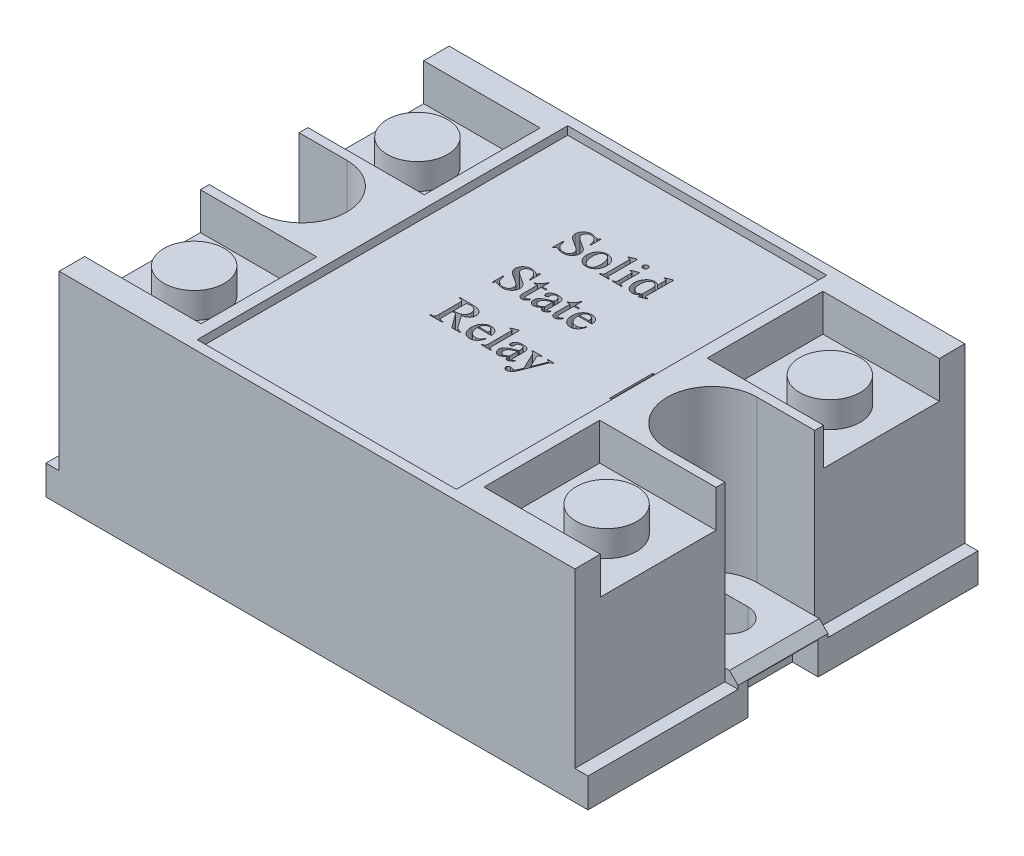
from build123d import *

# Parameters (mm, degrees)
SKETCH1_W                    = 62.75
SKETCH1_H                    = 45.15
BOSS_EXTRUDE1_DEPTH          = 23.4
SKETCH2_W                    = 30
SKETCH2_H                    = 42.9
CUT_EXTRUDE1_DEPTH           = 0.95
SKETCH3_W                    = 15
SKETCH3_H                    = 13.4
CUT_EXTRUDE2_DEPTH           = 4.3
SKETCH4_R                    = 3.5
BOSS_EXTRUDE2_DEPTH          = 3
CUT_EXTRUDE3_DEPTH           = 18.6
CUT_EXTRUDE_THIN1_DEPTH      = 45.699258942
CUT_EXTRUDE_THIN1_DEPTH_BACK = 1
SKETCH6_W                    = 0.2
SKETCH6_H                    = 5
CUT_EXTRUDE4_DEPTH           = 43.895002623
SKETCH8_R                    = 2.25
CUT_EXTRUDE5_DEPTH           = 43.895002623
SKETCH9_W                    = 1.525
SKETCH9_H                    = 45.15
CUT_EXTRUDE6_DEPTH           = 20
SKETCH11_W                   = 1.525
SKETCH11_H                   = 10.4
BOSS_EXTRUDE3_DEPTH          = 1.4
CHAMFER1_SIZE                = 1
SKETCH10_W                   = 3
SKETCH10_H                   = 8.15
CUT_EXTRUDE7_DEPTH           = 3.75
CUT_EXTRUDE8_DEPTH           = 5


with BuildPart() as part:
    # Sketch1 → Boss-Extrude1 (new body)
    with BuildSketch(Plane(origin=(0, 0, 0), x_dir=(1, 0, 0), z_dir=(0, 1, 0))):
        Rectangle(SKETCH1_W, SKETCH1_H)
    extrude(amount=BOSS_EXTRUDE1_DEPTH)

    # Sketch2 → Cut-Extrude1 (cut)
    with BuildSketch(Plane(origin=(0, 23.4, 0), x_dir=(1, 0, 0), z_dir=(0, 1, 0))):
        Rectangle(SKETCH2_W, SKETCH2_H)
    extrude(amount=-CUT_EXTRUDE1_DEPTH, mode=Mode.SUBTRACT)

    # Sketch3 → Cut-Extrude2 (cut)
    with BuildSketch(Plane(origin=(0, 23.4, 0), x_dir=(1, 0, 0), z_dir=(0, 1, 0))):
        with Locations((-23.875, 12.925)):
            Rectangle(SKETCH3_W, SKETCH3_H)
        with Locations((-23.875, -12.925)):
            Rectangle(SKETCH3_W, SKETCH3_H)
        with Locations((23.875, -12.925)):
            Rectangle(SKETCH3_W, SKETCH3_H)
        with Locations((23.875, 12.925)):
            Rectangle(SKETCH3_W, SKETCH3_H)
    extrude(amount=-CUT_EXTRUDE2_DEPTH, mode=Mode.SUBTRACT)

    # Sketch4 → Boss-Extrude2 (add)
    with BuildSketch(Plane(origin=(0, 19.1, 0), x_dir=(1, 0, 0), z_dir=(0, 1, 0))):
        with Locations(Location((-23.875, 12.925, 0), (0, 0, 270))):
            Circle(SKETCH4_R)
        with Locations(Location((-23.875, -12.925, 0), (0, 0, 90))):
            Circle(SKETCH4_R)
        with Locations(Location((23.875, -12.925, 0), (0, 0, 270))):
            Circle(SKETCH4_R)
        with Locations(Location((23.875, 12.925, 0), (0, 0, 90))):
            Circle(SKETCH4_R)
    extrude(amount=BOSS_EXTRUDE2_DEPTH)

    # Sketch5 → Cut-Extrude3 (cut)
    with BuildSketch(Plane(origin=(0, 23.4, 0), x_dir=(1, 0, 0), z_dir=(0, 1, 0))):
        with BuildLine():
            Line((31.375, -5.2), (23.175, -5.2))
            ThreePointArc((23.175, -5.2), (17.975, 0), (23.175, 5.2))
            Line((23.175, 5.2), (31.375, 5.2))
            ThreePointArc((31.375, 5.2), (36.575, 0), (31.375, -5.2))
        make_face()
        with BuildLine():
            Line((-31.375, 5.2), (-24.325, 5.2))
            ThreePointArc((-24.325, 5.2), (-19.125, 0), (-24.325, -5.2))
            Line((-24.325, -5.2), (-31.375, -5.2))
            ThreePointArc((-31.375, -5.2), (-36.575, 0), (-31.375, 5.2))
        make_face()
    extrude(amount=-CUT_EXTRUDE3_DEPTH, mode=Mode.SUBTRACT)

    # Sketch6 → Cut-Extrude-Thin1 (cut, two sides: drawn at the far end of the back side and taken through both)
    with BuildSketch(Plane(origin=(0, 22.45, 0), x_dir=(1, 0, 0), z_dir=(0, 1, 0)).offset(-CUT_EXTRUDE_THIN1_DEPTH_BACK)):
        with Locations((13.9, 0)):
            Rectangle(SKETCH6_W, SKETCH6_H)
    extrude(amount=CUT_EXTRUDE_THIN1_DEPTH + CUT_EXTRUDE_THIN1_DEPTH_BACK, mode=Mode.SUBTRACT)

    # Sketch7 → Cut-Extrude4 (cut, through all)
    with BuildSketch(Plane(origin=(0, 4.8, 0), x_dir=(1, 0, 0), z_dir=(0, 1, 0))):
        with BuildLine():
            Line((22.275, 2.25), (25.075, 2.25))
            ThreePointArc((25.075, 2.25), (27.325, 0), (25.075, -2.25))
            Line((25.075, -2.25), (22.275, -2.25))
            ThreePointArc((22.275, -2.25), (20.025, 0), (22.275, 2.25))
        make_face()
    extrude(amount=-CUT_EXTRUDE4_DEPTH, mode=Mode.SUBTRACT)

    # Sketch8 → Cut-Extrude5 (cut, through all)
    with BuildSketch(Plane(origin=(0, 4.8, 0), x_dir=(1, 0, 0), z_dir=(0, 1, 0))):
        with Locations(Location((-23.825, 0, 0), (0, 0, 270))):
            Circle(SKETCH8_R)
    extrude(amount=-CUT_EXTRUDE5_DEPTH, mode=Mode.SUBTRACT)

    # Sketch9 → Cut-Extrude6 (cut)
    with BuildSketch(Plane(origin=(0, 23.4, 0), x_dir=(1, 0, 0), z_dir=(0, 1, 0))):
        with Locations((-30.6125, 0)):
            Rectangle(SKETCH9_W, SKETCH9_H)
        with Locations((30.6125, 0)):
            Rectangle(SKETCH9_W, SKETCH9_H)
    extrude(amount=-CUT_EXTRUDE6_DEPTH, mode=Mode.SUBTRACT)

    # Sketch11 → Boss-Extrude3 (add)
    with BuildSketch(Plane(origin=(0, 3.4, 0), x_dir=(1, 0, 0), z_dir=(0, 1, 0))):
        with Locations((-30.6125, 0)):
            Rectangle(SKETCH11_W, SKETCH11_H)
        with Locations((30.6125, 0)):
            Rectangle(SKETCH11_W, SKETCH11_H)
    extrude(amount=BOSS_EXTRUDE3_DEPTH)

    # Chamfer1
    chamfer1_edges = [part.edges().sort_by_distance(p)[0] for p in [
        (-31.375, 4.8, 0),
        (31.375, 4.8, 0),
    ]]
    chamfer(chamfer1_edges, length=CHAMFER1_SIZE)

    # Sketch10 → Cut-Extrude7 (cut)
    with BuildSketch(Plane.XZ):
        with Locations((29.875, 0)):
            Rectangle(SKETCH10_W, SKETCH10_H)
        with Locations((-29.875, 0)):
            Rectangle(SKETCH10_W, SKETCH10_H)
    extrude(amount=-CUT_EXTRUDE7_DEPTH, mode=Mode.SUBTRACT)

    # Sketch14 → Cut-Extrude8 (cut)
    # profile 1 of 16: a face of its own
    with BuildSketch(Plane(origin=(0, 22.45, 0), x_dir=(1, 0, 0), z_dir=(0, 1, 0))):
        with BuildLine():
            Line((-2.639211931, 12.939539334), (-2.639211931, 11.724261557))
            Line((-2.639211931, 11.724261557), (-2.736434153, 11.724261557))
            add(Edge.make_bspline(
                [(-2.736434153, 11.724261557), (-2.744325096, 11.783108277), (-2.759337889, 11.895066207), (-2.791887613, 12.05320948), (-2.835194045, 12.191920163), (-2.886292855, 12.313748023), (-2.947515705, 12.420821347), (-3.021688122, 12.514207627), (-3.106231745, 12.597395336), (-3.202491984, 12.666171887), (-3.304508991, 12.722286102), (-3.409591531, 12.764255814), (-3.517428294, 12.788411812), (-3.589801322, 12.791945251), (-3.625865577, 12.793706001)],
                knots=[0, 0, 0, 0, 1.391615872, 2.647597524, 3.779493633, 4.792580943, 5.739275105, 6.660626987, 7.579777993, 8.510505953, 9.424199044, 10.303693636, 11.154712373, 12, 12, 12, 12], degree=3))
            add(Edge.make_bspline(
                [(-3.625865577, 12.793706001), (-3.645903291, 12.793422508), (-3.685404631, 12.792863645), (-3.743033273, 12.783854718), (-3.79833964, 12.771234486), (-3.851004152, 12.752791578), (-3.901303166, 12.729374608), (-3.948391961, 12.700190319), (-3.993278201, 12.666500038), (-4.047124529, 12.614671767), (-4.106193711, 12.544617898), (-4.157147194, 12.450862952), (-4.189432484, 12.351210068), (-4.192982355, 12.282262413), (-4.194767487, 12.24759055)],
                knots=[0, 0, 0, 0, 0.822889295, 1.622202463, 2.392243957, 3.152657784, 3.911645477, 4.668560503, 5.426333872, 6.21417893, 7.737497937, 9.172141173, 10.577948251, 12, 12, 12, 12], degree=3))
            add(Edge.make_bspline(
                [(-4.194767487, 12.24759055), (-4.193752111, 12.220865006), (-4.191752183, 12.168225178), (-4.171073154, 12.091565119), (-4.140824402, 12.017680031), (-4.110076147, 11.973657147), (-4.09450707, 11.951366591)],
                knots=[0, 0, 0, 0, 1.005601748, 1.980678245, 2.977536257, 4, 4, 4, 4], degree=3))
            add(Edge.make_bspline(
                [(-4.09450707, 11.951366591), (-4.080616191, 11.934147036), (-4.050414591, 11.896708218), (-3.994787106, 11.841847949), (-3.928218114, 11.781548742), (-3.847630707, 11.719139298), (-3.755621483, 11.651270474), (-3.650885431, 11.579506788), (-3.533884579, 11.503519598), (-3.451044456, 11.452898155), (-3.407875125, 11.426518501)],
                knots=[0, 0, 0, 0, 0.611101905, 1.328659962, 2.156268474, 3.09294578, 4.144138902, 5.3166236, 6.60164907, 8, 8, 8, 8], degree=3))
            add(Edge.make_bspline(
                [(-3.407875125, 11.426518501), (-3.372405486, 11.405037377), (-3.303878737, 11.363536205), (-3.205278286, 11.302948686), (-3.114793279, 11.246120662), (-3.032899028, 11.192596958), (-2.958279458, 11.144390947), (-2.892060369, 11.099382898), (-2.833874991, 11.058542664), (-2.767081284, 11.010553871), (-2.693531947, 10.95028097), (-2.615916868, 10.871892869), (-2.550445526, 10.785879142), (-2.495052912, 10.695078298), (-2.450540843, 10.600229257), (-2.41951644, 10.502135998), (-2.39939947, 10.401950488), (-2.397239759, 10.334129308), (-2.396156375, 10.300107911)],
                knots=[0, 0, 0, 0, 1.248757792, 2.412579105, 3.485054527, 4.466330029, 5.358748662, 6.160222748, 6.877285666, 7.499507807, 8.636803392, 9.736681065, 10.813322086, 11.884251586, 12.9349048, 13.959676984, 14.976504968, 16, 16, 16, 16], degree=3))
            add(Edge.make_bspline(
                [(-2.396156375, 10.300107911), (-2.396934873, 10.267895562), (-2.398469391, 10.204400944), (-2.413546643, 10.111245298), (-2.437160313, 10.021674662), (-2.469877079, 9.935165608), (-2.512911913, 9.852170846), (-2.56466642, 9.772197033), (-2.625835692, 9.695707302), (-2.696204696, 9.624430114), (-2.773222395, 9.558168636), (-2.856827655, 9.500565556), (-2.945852824, 9.451400139), (-3.040021681, 9.41126441), (-3.139699962, 9.379779473), (-3.244802445, 9.358026351), (-3.355390815, 9.344996761), (-3.430878968, 9.34322248), (-3.469398563, 9.342317112)],
                knots=[0, 0, 0, 0, 0.963313627, 1.898813136, 2.815875059, 3.731934866, 4.660412485, 5.608226541, 6.578517028, 7.585790218, 8.601547949, 9.614560958, 10.618351627, 11.640082467, 12.672878095, 13.741299665, 14.847445351, 16, 16, 16, 16], degree=3))
            add(Edge.make_bspline(
                [(-3.469398563, 9.342317112), (-3.517331955, 9.343354603), (-3.610711768, 9.345375755), (-3.703159911, 9.358645435), (-3.748152903, 9.36510357)],
                knots=[0, 0, 0, 0, 1.026632861, 2, 2, 2, 2], degree=3))
            add(Edge.make_bspline(
                [(-3.748152903, 9.36510357), (-3.755498151, 9.366608034), (-3.771990343, 9.369985986), (-3.79941708, 9.375987835), (-3.832070142, 9.384436742), (-3.869909033, 9.395318723), (-3.913133855, 9.407091727), (-3.961366179, 9.421963629), (-4.014895192, 9.438335155), (-4.071724903, 9.45699589), (-4.127999267, 9.475557943), (-4.180752811, 9.49149403), (-4.227845583, 9.505168927), (-4.269263348, 9.51675351), (-4.305298915, 9.525125723), (-4.335677489, 9.531272931), (-4.360502494, 9.535368787), (-4.375277468, 9.53634341), (-4.381616445, 9.536761557)],
                knots=[0, 0, 0, 0, 0.547610857, 1.229543858, 2.050283417, 3.010418186, 4.10517149, 5.321963087, 6.696442991, 8.193455647, 9.690468303, 11.02416608, 12.217978543, 13.272156507, 14.164742802, 14.91905115, 15.53623542, 16, 16, 16, 16], degree=3))
            add(Edge.make_bspline(
                [(-4.381616445, 9.536761557), (-4.391526162, 9.53634916), (-4.410591487, 9.53555575), (-4.437916623, 9.528752693), (-4.461675851, 9.516385404), (-4.483029703, 9.49885366), (-4.499685637, 9.472689206), (-4.515320342, 9.438445185), (-4.526362416, 9.393587915), (-4.531995355, 9.360326326), (-4.535045264, 9.342317112)],
                knots=[0, 0, 0, 0, 0.858084681, 1.650870771, 2.416167262, 3.163326943, 4.015220049, 5.07550074, 6.416553863, 8, 8, 8, 8], degree=3))
            Line((-4.535045264, 9.342317112), (-4.632267487, 9.342317112))
            Line((-4.632267487, 9.342317112), (-4.632267487, 10.55759489))
            Line((-4.632267487, 10.55759489), (-4.535045264, 10.55759489))
            add(Edge.make_bspline(
                [(-4.535045264, 10.55759489), (-4.5297045, 10.52489165), (-4.519369304, 10.461605881), (-4.500607935, 10.37033818), (-4.482458998, 10.285157229), (-4.46057032, 10.206909729), (-4.439050456, 10.134459446), (-4.415181522, 10.068520103), (-4.39158072, 10.008142735), (-4.355871009, 9.93720764), (-4.303472152, 9.856011056), (-4.227920768, 9.766998038), (-4.136860423, 9.687702882), (-4.033782638, 9.617738702), (-3.920727035, 9.559954654), (-3.80020733, 9.519027886), (-3.674598605, 9.492729079), (-3.588778648, 9.489688825), (-3.545353424, 9.488150445)],
                knots=[0, 0, 0, 0, 0.983972942, 1.904138093, 2.767005898, 3.569583276, 4.316441937, 5.010894174, 5.651787391, 6.240252764, 7.366542846, 8.51322938, 9.695910635, 10.940957651, 12.205335424, 13.453715602, 14.711570431, 16, 16, 16, 16], degree=3))
            add(Edge.make_bspline(
                [(-3.545353424, 9.488150445), (-3.520526551, 9.488850584), (-3.472023387, 9.490218414), (-3.401035493, 9.497484523), (-3.333946639, 9.51126869), (-3.271020965, 9.530346578), (-3.211747537, 9.553462956), (-3.157472392, 9.583923934), (-3.106404362, 9.618452836), (-3.060234277, 9.6589684), (-3.018971426, 9.702795488), (-2.981917304, 9.748298473), (-2.951421746, 9.796649133), (-2.926409109, 9.84683506), (-2.906279235, 9.898594617), (-2.892746734, 9.952445883), (-2.884095659, 10.008162112), (-2.882883027, 10.046133063), (-2.882267487, 10.06540739)],
                knots=[0, 0, 0, 0, 1.21237399, 2.368561524, 3.478840252, 4.550321735, 5.576348489, 6.577655339, 7.582237555, 8.581099954, 9.56911946, 10.518897773, 11.44133683, 12.353448509, 13.253333502, 14.146743192, 15.059273559, 16, 16, 16, 16], degree=3))
            add(Edge.make_bspline(
                [(-2.882267487, 10.06540739), (-2.882949075, 10.087238028), (-2.884322778, 10.131236471), (-2.897273813, 10.197262099), (-2.91781106, 10.263501773), (-2.946901067, 10.329713287), (-2.984161554, 10.394966668), (-3.029850276, 10.458696634), (-3.086121605, 10.518642363), (-3.12805651, 10.555899005), (-3.149628598, 10.575064508)],
                knots=[0, 0, 0, 0, 0.880647729, 1.774896773, 2.706128403, 3.676651084, 4.688504397, 5.735483579, 6.835091053, 8, 8, 8, 8], degree=3))
            add(Edge.make_bspline(
                [(-3.149628598, 10.575064508), (-3.158932065, 10.582492231), (-3.180428568, 10.599654657), (-3.218890988, 10.626622504), (-3.26627994, 10.660213011), (-3.324500588, 10.698125779), (-3.39263454, 10.740975748), (-3.470324656, 10.790059222), (-3.558243619, 10.843475439), (-3.65324856, 10.901353547), (-3.749692008, 10.960373002), (-3.842903192, 11.016978127), (-3.928313238, 11.072228054), (-4.008662572, 11.122701977), (-4.0818059, 11.171627441), (-4.149604499, 11.216020624), (-4.210338295, 11.257862822), (-4.281691296, 11.30869268), (-4.361097805, 11.37208413), (-4.445840062, 11.451695292), (-4.516684443, 11.536875831), (-4.576613982, 11.624958523), (-4.624031228, 11.717832852), (-4.656282827, 11.815747264), (-4.676978423, 11.917841926), (-4.679566692, 11.987471377), (-4.680878598, 12.022764161)],
                knots=[0, 0, 0, 0, 0.389655712, 0.900334728, 1.537269357, 2.291310688, 3.174316797, 4.172404975, 5.299694727, 6.542110962, 7.814388237, 9.001405823, 10.111994972, 11.144392138, 12.107627027, 12.992692561, 13.797376976, 14.521960454, 15.860446118, 17.120896578, 18.321180878, 19.479817337, 20.602985803, 21.722201974, 22.845462189, 24, 24, 24, 24], degree=3))
            add(Edge.make_bspline(
                [(-4.680878598, 12.022764161), (-4.67996057, 12.053443801), (-4.678146643, 12.114063604), (-4.664977653, 12.203451368), (-4.643121057, 12.289612661), (-4.611471918, 12.372157488), (-4.571781647, 12.451528384), (-4.523623572, 12.527978386), (-4.466481269, 12.601124153), (-4.400414954, 12.669576147), (-4.328598058, 12.733184422), (-4.250108315, 12.788167194), (-4.167643543, 12.835377639), (-4.080018372, 12.873702725), (-3.987618896, 12.903316707), (-3.890490717, 12.924562211), (-3.788460721, 12.93666952), (-3.719068416, 12.938568481), (-3.683591271, 12.939539334)],
                knots=[0, 0, 0, 0, 0.974899241, 1.926300239, 2.865093898, 3.794703015, 4.730387505, 5.681482166, 6.661813011, 7.674920949, 8.701427092, 9.706126817, 10.715231942, 11.716962423, 12.739993052, 13.794382224, 14.872367468, 16, 16, 16, 16], degree=3))
            add(Edge.make_bspline(
                [(-3.683591271, 12.939539334), (-3.637669592, 12.93778325), (-3.543702971, 12.934189887), (-3.40100477, 12.908780946), (-3.254565773, 12.866789434), (-3.158157834, 12.827545611), (-3.108612973, 12.807377876)],
                knots=[0, 0, 0, 0, 0.927627064, 1.898144454, 2.919838524, 4, 4, 4, 4], degree=3))
            add(Edge.make_bspline(
                [(-3.108612973, 12.807377876), (-3.086983342, 12.797861213), (-3.047452036, 12.780468124), (-2.992008239, 12.762385373), (-2.947774196, 12.748034209), (-2.921075529, 12.745977872), (-2.909611237, 12.74509489)],
                knots=[0, 0, 0, 0, 1.351973675, 2.470929114, 3.343423542, 4, 4, 4, 4], degree=3))
            add(Edge.make_bspline(
                [(-2.909611237, 12.74509489), (-2.899175593, 12.745423229), (-2.879010534, 12.746057688), (-2.850438657, 12.754045325), (-2.824928798, 12.766315909), (-2.801456891, 12.783723924), (-2.781265654, 12.80967145), (-2.763327265, 12.844076786), (-2.748461509, 12.88855129), (-2.740692059, 12.921488626), (-2.736434153, 12.939539334)],
                knots=[0, 0, 0, 0, 0.869133882, 1.67944953, 2.454811455, 3.224387015, 4.096088506, 5.174323703, 6.45143945, 8, 8, 8, 8], degree=3))
            Line((-2.736434153, 12.939539334), (-2.639211931, 12.939539334))
        make_face()
    # profile 2 of 16: a face of its own
    with BuildSketch(Plane(origin=(0, 22.45, 0), x_dir=(1, 0, 0), z_dir=(0, 1, 0))):
        with BuildLine():
            add(Edge.make_bspline(
                [(-0.765405507, 11.821483779), (-0.721533397, 11.820426373), (-0.635636002, 11.818356074), (-0.510268453, 11.798899893), (-0.391806516, 11.76702089), (-0.280042421, 11.722474589), (-0.174131971, 11.666350693), (-0.076106726, 11.595543121), (0.016071596, 11.513184992), (0.070512663, 11.450198334), (0.098201263, 11.418163466)],
                knots=[0, 0, 0, 0, 1.065475926, 2.086099963, 3.0740863, 4.040596107, 5.003967888, 5.978764027, 6.972004072, 8, 8, 8, 8], degree=3))
            add(Edge.make_bspline(
                [(0.098201263, 11.418163466), (0.120191432, 11.389124496), (0.163609538, 11.331789007), (0.220112959, 11.240614042), (0.268203626, 11.146473338), (0.307031257, 11.048482869), (0.337537365, 10.947649677), (0.358685427, 10.843380336), (0.371965583, 10.736178879), (0.373766678, 10.663464093), (0.374676958, 10.626713813)],
                knots=[0, 0, 0, 0, 1.022008931, 2.017887745, 3.006334525, 3.985540882, 4.972555944, 5.959340715, 6.968644432, 8, 8, 8, 8], degree=3))
            add(Edge.make_bspline(
                [(0.374676958, 10.626713813), (0.372633594, 10.573934828), (0.368518831, 10.467652715), (0.339096391, 10.307772819), (0.290827237, 10.147534794), (0.236063654, 10.01537586), (0.18282499, 9.91310056), (0.13958306, 9.839819702), (0.092633355, 9.771342926), (0.041616068, 9.708322077), (-0.012612483, 9.650091922), (-0.070548206, 9.596832498), (-0.132000814, 9.547962567), (-0.218896195, 9.490852831), (-0.333655006, 9.430847153), (-0.480329995, 9.380082794), (-0.634327778, 9.34731555), (-0.739919404, 9.343999871), (-0.793508806, 9.342317112)],
                knots=[0, 0, 0, 0, 1.308834484, 2.635626516, 4.018558774, 5.454313625, 6.176211117, 6.877377291, 7.56373373, 8.233630339, 8.886803348, 9.535705325, 10.184029623, 10.831988804, 12.112861064, 13.384043246, 14.672361028, 16, 16, 16, 16], degree=3))
            add(Edge.make_bspline(
                [(-0.793508806, 9.342317112), (-0.836879878, 9.343638489), (-0.922057735, 9.346233585), (-1.046180373, 9.366366328), (-1.163838871, 9.399014624), (-1.274380264, 9.445451264), (-1.377897176, 9.505626637), (-1.475024353, 9.577937791), (-1.564584334, 9.664704476), (-1.617294009, 9.730352228), (-1.64420325, 9.763866591)],
                knots=[0, 0, 0, 0, 1.054286533, 2.07054756, 3.049048718, 4.017581598, 4.977524521, 5.954009108, 6.955484704, 8, 8, 8, 8], degree=3))
            add(Edge.make_bspline(
                [(-1.64420325, 9.763866591), (-1.665462798, 9.79366888), (-1.707487538, 9.852580455), (-1.76122852, 9.945770039), (-1.807609973, 10.041250866), (-1.844054397, 10.139964661), (-1.874845339, 10.240891841), (-1.894340569, 10.345113401), (-1.908353216, 10.4516373), (-1.90947853, 10.523620899), (-1.910045264, 10.559873536)],
                knots=[0, 0, 0, 0, 1.027995455, 2.03208656, 3.018382236, 4.006625493, 4.985712438, 5.978986255, 6.982169867, 8, 8, 8, 8], degree=3))
            add(Edge.make_bspline(
                [(-1.910045264, 10.559873536), (-1.908201627, 10.613694842), (-1.904493868, 10.721935423), (-1.872256414, 10.883261495), (-1.822091838, 11.043904747), (-1.763351254, 11.174405174), (-1.708404115, 11.276017641), (-1.663161294, 11.347970035), (-1.614038366, 11.414411379), (-1.562579655, 11.476073179), (-1.507802657, 11.532533748), (-1.44962063, 11.583433963), (-1.389140911, 11.630449223), (-1.303092949, 11.682867788), (-1.192655988, 11.739214449), (-1.053416335, 11.786125164), (-0.910800992, 11.816674803), (-0.813917538, 11.819879236), (-0.765405507, 11.821483779)],
                knots=[0, 0, 0, 0, 1.363272819, 2.741691909, 4.154573289, 5.6228479, 6.361000545, 7.082187089, 7.775412212, 8.454224844, 9.116915007, 9.76721148, 10.412930582, 11.055868397, 12.318857477, 13.54686811, 14.771653937, 16, 16, 16, 16], degree=3))
        make_face()
        with BuildLine():
            add(Edge.make_bspline(
                [(-0.844398563, 11.675650445), (-0.867269963, 11.674573007), (-0.913252874, 11.67240682), (-0.982267034, 11.656145304), (-1.051282137, 11.630335979), (-1.119885293, 11.59373493), (-1.186656902, 11.545290196), (-1.24532117, 11.478641676), (-1.297612247, 11.397356355), (-1.342974786, 11.300876907), (-1.380403798, 11.189714159), (-1.405081403, 11.063068257), (-1.421333582, 10.922348399), (-1.423041146, 10.82348851), (-1.423934153, 10.771787598)],
                knots=[0, 0, 0, 0, 0.685027346, 1.377246338, 2.114424952, 2.888451615, 3.701944125, 4.572275557, 5.532062909, 6.591086495, 7.759739625, 9.038147969, 10.451035577, 12, 12, 12, 12], degree=3))
            add(Edge.make_bspline(
                [(-1.423934153, 10.771787598), (-1.423450368, 10.728724758), (-1.422501374, 10.644252606), (-1.412075291, 10.51978763), (-1.396431967, 10.400083137), (-1.374478294, 10.284585349), (-1.34554067, 10.173785752), (-1.310613867, 10.067210305), (-1.269657676, 9.965017111), (-1.222396417, 9.868649477), (-1.169813488, 9.780317615), (-1.113161499, 9.701963269), (-1.051401207, 9.636375886), (-0.986126626, 9.582032327), (-0.916439408, 9.539501664), (-0.842211907, 9.509879851), (-0.76400331, 9.491621936), (-0.710564233, 9.489321112), (-0.683374257, 9.488150445)],
                knots=[0, 0, 0, 0, 1.268393838, 2.48808387, 3.676981921, 4.823886065, 5.949193386, 7.04838886, 8.126012347, 9.190153483, 10.207134928, 11.151496333, 12.032709656, 12.854055169, 13.647176273, 14.426997578, 15.199651256, 16, 16, 16, 16], degree=3))
            add(Edge.make_bspline(
                [(-0.683374257, 9.488150445), (-0.663080745, 9.488669314), (-0.623003021, 9.489694028), (-0.564283174, 9.499776295), (-0.508549901, 9.516662765), (-0.455373631, 9.539605096), (-0.405311434, 9.569466777), (-0.357655017, 9.60536071), (-0.313505876, 9.648610073), (-0.271475041, 9.698021457), (-0.232697266, 9.755588028), (-0.200664855, 9.823195074), (-0.172467394, 9.89938043), (-0.149845385, 9.985115383), (-0.132930767, 10.080174923), (-0.120002347, 10.184359407), (-0.112449348, 10.297970098), (-0.111781624, 10.376810695), (-0.111434153, 10.417837945)],
                knots=[0, 0, 0, 0, 0.7925425, 1.565194785, 2.319575442, 3.064027887, 3.822549968, 4.592346092, 5.390059812, 6.232539397, 7.124410449, 8.093508243, 9.148505951, 10.295746887, 11.55331183, 12.919243719, 14.396828985, 16, 16, 16, 16], degree=3))
            add(Edge.make_bspline(
                [(-0.111434153, 10.417837945), (-0.112420906, 10.469758741), (-0.114344233, 10.570960058), (-0.126015872, 10.7184745), (-0.14771192, 10.857136024), (-0.175878476, 10.987661205), (-0.214024814, 11.1095813), (-0.260464762, 11.223159758), (-0.314474139, 11.32883844), (-0.358596615, 11.392771193), (-0.380314362, 11.424239855)],
                knots=[0, 0, 0, 0, 1.176782824, 2.293723966, 3.350316679, 4.355440551, 5.317295722, 6.24112299, 7.134254284, 8, 8, 8, 8], degree=3))
            add(Edge.make_bspline(
                [(-0.380314362, 11.424239855), (-0.395565501, 11.444368848), (-0.425211927, 11.48349725), (-0.47609123, 11.534534728), (-0.529244312, 11.578716176), (-0.586666961, 11.613377956), (-0.646613327, 11.641498677), (-0.709788524, 11.660832731), (-0.776014759, 11.67384397), (-0.821294551, 11.675040113), (-0.844398563, 11.675650445)],
                knots=[0, 0, 0, 0, 1.101841247, 2.141850159, 3.140102416, 4.113043798, 5.063027868, 6.02484522, 6.992177371, 8, 8, 8, 8], degree=3))
        make_face(mode=Mode.SUBTRACT)
    # profile 3 of 16: a face of its own
    with BuildSketch(Plane(origin=(0, 22.45, 0), x_dir=(1, 0, 0), z_dir=(0, 1, 0))):
        with BuildLine():
            Line((1.492732513, 13.036761557), (1.492732513, 9.925650445))
            add(Edge.make_bspline(
                [(1.492732513, 9.925650445), (1.492725773, 9.891955283), (1.492713544, 9.830826774), (1.499541797, 9.748529193), (1.506094344, 9.684400593), (1.519030294, 9.636258759), (1.537573828, 9.600835179), (1.556883589, 9.570296715), (1.581722304, 9.54554724), (1.610411066, 9.522908467), (1.649393285, 9.50717265), (1.699190187, 9.495323416), (1.761981297, 9.489257952), (1.807937174, 9.488541393), (1.833010291, 9.488150445)],
                knots=[0, 0, 0, 0, 1.823513576, 3.308150443, 4.469544864, 5.311286748, 5.985684238, 6.628258447, 7.258428863, 7.875337394, 8.593593682, 9.511283122, 10.642178235, 12, 12, 12, 12], degree=3))
            Line((1.833010291, 9.488150445), (1.833010291, 9.390928223))
            Line((1.833010291, 9.390928223), (0.714954736, 9.390928223))
            Line((0.714954736, 9.390928223), (0.714954736, 9.488150445))
            add(Edge.make_bspline(
                [(0.714954736, 9.488150445), (0.739267575, 9.488601232), (0.783932231, 9.489429365), (0.844832703, 9.49482988), (0.893138484, 9.504956536), (0.931141153, 9.519372862), (0.959374436, 9.541217437), (0.985459253, 9.565016078), (1.005297702, 9.596818229), (1.02519529, 9.633888665), (1.039513068, 9.683814852), (1.048260133, 9.749154566), (1.054070462, 9.831619513), (1.054822486, 9.892471806), (1.055232513, 9.925650445)],
                knots=[0, 0, 0, 0, 1.319745898, 2.424480119, 3.31125756, 3.995122181, 4.605305862, 5.236927329, 5.900046948, 6.625183393, 7.516208894, 8.697744616, 10.199503502, 12, 12, 12, 12], degree=3))
            Line((1.055232513, 9.925650445), (1.055232513, 12.064539334))
            add(Edge.make_bspline(
                [(1.055232513, 12.064539334), (1.05528271, 12.094921208), (1.055378084, 12.152647941), (1.054742994, 12.234433402), (1.052957097, 12.307089025), (1.051724353, 12.370399225), (1.049606364, 12.424605413), (1.046333122, 12.469394554), (1.043743077, 12.505170361), (1.038969859, 12.539540767), (1.030761686, 12.573184032), (1.021501297, 12.607917187), (1.006595198, 12.634789931), (0.985539672, 12.661780429), (0.949865833, 12.684626578), (0.917602875, 12.687442858), (0.901044145, 12.688888293)],
                knots=[0, 0, 0, 0, 1.824075608, 3.465814027, 4.910193861, 6.187408655, 7.26761638, 8.166512293, 8.883524579, 9.420948009, 10.24697324, 10.963340731, 11.568699979, 12.076728596, 13.012894912, 14, 14, 14, 14], degree=3))
            add(Edge.make_bspline(
                [(0.901044145, 12.688888293), (0.89062365, 12.688440507), (0.868270698, 12.687479965), (0.832944915, 12.678949895), (0.793700961, 12.66631144), (0.767000344, 12.654235375), (0.752932166, 12.647872668)],
                knots=[0, 0, 0, 0, 0.806788497, 1.730637987, 2.804305231, 4, 4, 4, 4], degree=3))
            Line((0.752932166, 12.647872668), (0.714954736, 12.74509489))
            Line((0.714954736, 12.74509489), (1.382597965, 13.036761557))
            Line((1.382597965, 13.036761557), (1.492732513, 13.036761557))
        make_face()
    # profile 4 of 16: a face of its own
    with BuildSketch(Plane(origin=(0, 22.45, 0), x_dir=(1, 0, 0), z_dir=(0, 1, 0))):
        with BuildLine():
            add(Edge.make_bspline(
                [(2.709529388, 13.036761557), (2.72915423, 13.035836002), (2.767328881, 13.034035594), (2.822045659, 13.017021765), (2.872245864, 12.990405658), (2.91553235, 12.952616949), (2.953321059, 12.909330463), (2.979937167, 12.859130257), (2.996950996, 12.80441348), (2.998751404, 12.766238828), (2.999676958, 12.746613987)],
                knots=[0, 0, 0, 0, 1.030380414, 2.004317557, 2.988142639, 4, 5.011857361, 5.995682443, 6.969619586, 8, 8, 8, 8], degree=3))
            add(Edge.make_bspline(
                [(2.999676958, 12.746613987), (2.99871347, 12.727003632), (2.996827331, 12.68861408), (2.980187422, 12.633471902), (2.952828479, 12.583045477), (2.916124294, 12.538312601), (2.871961143, 12.500746168), (2.822291036, 12.472987777), (2.767294835, 12.456211616), (2.72914267, 12.454373277), (2.709529388, 12.453428223)],
                knots=[0, 0, 0, 0, 1.025297121, 2.007138425, 2.986109891, 4.013377504, 5.020242953, 6.005570572, 6.974702879, 8, 8, 8, 8], degree=3))
            add(Edge.make_bspline(
                [(2.709529388, 12.453428223), (2.689930555, 12.454411142), (2.651563559, 12.45633532), (2.59614014, 12.472734297), (2.546249814, 12.501245189), (2.500624728, 12.537709326), (2.46416059, 12.583334413), (2.435649699, 12.633224739), (2.419250721, 12.688648157), (2.417326543, 12.727015154), (2.416343625, 12.746613987)],
                knots=[0, 0, 0, 0, 1.020263738, 1.997284992, 2.977775445, 4, 5.022224555, 6.002715008, 6.979736262, 8, 8, 8, 8], degree=3))
            add(Edge.make_bspline(
                [(2.416343625, 12.746613987), (2.417251092, 12.766248093), (2.419016316, 12.804440767), (2.436247688, 12.858913486), (2.461811909, 12.909515671), (2.499824813, 12.952839924), (2.543828385, 12.990399851), (2.594958092, 13.017210233), (2.650767917, 13.033929191), (2.689662033, 13.035803929), (2.709529388, 13.036761557)],
                knots=[0, 0, 0, 0, 1.023401674, 1.990742365, 2.96169862, 3.966702697, 4.98185377, 5.970689565, 6.963415644, 8, 8, 8, 8], degree=3))
        make_face()
    # profile 5 of 16: a face of its own
    with BuildSketch(Plane(origin=(0, 22.45, 0), x_dir=(1, 0, 0), z_dir=(0, 1, 0))):
        with BuildLine():
            Line((2.951065847, 11.821483779), (2.951065847, 9.925650445))
            add(Edge.make_bspline(
                [(2.951065847, 9.925650445), (2.951593892, 9.891977847), (2.952551517, 9.830911679), (2.956948715, 9.748071057), (2.966411112, 9.683791094), (2.978746005, 9.634624982), (2.997920521, 9.598410673), (3.018917277, 9.568504438), (3.044091153, 9.543697222), (3.073238267, 9.521692009), (3.111820113, 9.505364212), (3.16134121, 9.496023038), (3.222280982, 9.489042392), (3.267010207, 9.488464713), (3.291343625, 9.488150445)],
                knots=[0, 0, 0, 0, 1.827231777, 3.31373418, 4.494792293, 5.351337946, 6.045469825, 6.704897256, 7.326476523, 7.955597673, 8.675216834, 9.575048766, 10.68078758, 12, 12, 12, 12], degree=3))
            Line((3.291343625, 9.488150445), (3.291343625, 9.390928223))
            Line((3.291343625, 9.390928223), (2.173288069, 9.390928223))
            Line((2.173288069, 9.390928223), (2.173288069, 9.488150445))
            add(Edge.make_bspline(
                [(2.173288069, 9.488150445), (2.198106019, 9.488602558), (2.243526918, 9.489429998), (2.305201379, 9.494755377), (2.353743446, 9.504985124), (2.391578269, 9.519228915), (2.419330831, 9.540951353), (2.443610682, 9.565812884), (2.464741671, 9.596281829), (2.483191658, 9.634208399), (2.497992084, 9.683731781), (2.506537269, 9.749186611), (2.512422806, 9.831608672), (2.513162527, 9.892467981), (2.513565847, 9.925650445)],
                knots=[0, 0, 0, 0, 1.345838407, 2.463103905, 3.348975853, 4.032142177, 4.630628879, 5.242195399, 5.912414147, 6.630671645, 7.520787315, 8.701116565, 10.201341998, 12, 12, 12, 12], degree=3))
            Line((2.513565847, 9.925650445), (2.513565847, 10.849261557))
            add(Edge.make_bspline(
                [(2.513565847, 10.849261557), (2.51371344, 10.878632046), (2.513995926, 10.934845864), (2.512083119, 11.015098391), (2.510516114, 11.087252034), (2.509485918, 11.151343028), (2.506418781, 11.207313587), (2.502383553, 11.255126276), (2.499145219, 11.294734968), (2.495451469, 11.318170362), (2.493817583, 11.32853673)],
                knots=[0, 0, 0, 0, 1.468246674, 2.810159154, 4.01286899, 5.07638342, 6.014390898, 6.814308156, 7.475523319, 8, 8, 8, 8], degree=3))
            add(Edge.make_bspline(
                [(2.493817583, 11.32853673), (2.491050151, 11.340767805), (2.485840792, 11.363791337), (2.474606635, 11.394616343), (2.461756463, 11.420260405), (2.44058519, 11.445372706), (2.405043923, 11.468486141), (2.372205973, 11.470346773), (2.354820187, 11.471331869)],
                knots=[0, 0, 0, 0, 1.023772961, 1.927129924, 2.676903813, 3.35248345, 4.598293855, 6, 6, 6, 6], degree=3))
            add(Edge.make_bspline(
                [(2.354820187, 11.471331869), (2.343890868, 11.470907254), (2.320777766, 11.470009287), (2.284779427, 11.461399555), (2.245355738, 11.449488542), (2.218521354, 11.43841175), (2.204429562, 11.43259489)],
                knots=[0, 0, 0, 0, 0.838083998, 1.772363154, 2.830180171, 4, 4, 4, 4], degree=3))
            Line((2.204429562, 11.43259489), (2.173288069, 11.529817112))
            Line((2.173288069, 11.529817112), (2.843969493, 11.821483779))
            Line((2.843969493, 11.821483779), (2.951065847, 11.821483779))
        make_face()
    # profile 6 of 16: a face of its own
    with BuildSketch(Plane(origin=(0, 22.45, 0), x_dir=(1, 0, 0), z_dir=(0, 1, 0))):
        with BuildLine():
            add(Edge.make_bspline(
                [(5.235788069, 9.712217286), (5.208741675, 9.679576869), (5.157240117, 9.617423214), (5.075210079, 9.536285389), (4.99337209, 9.471616301), (4.911879682, 9.421648514), (4.828600879, 9.386405815), (4.743549065, 9.361058097), (4.655047881, 9.345470426), (4.594791115, 9.343375532), (4.564347097, 9.342317112)],
                knots=[0, 0, 0, 0, 1.276681338, 2.431047791, 3.468744646, 4.413295535, 5.301751392, 6.185116711, 7.083051697, 8, 8, 8, 8], degree=3))
            add(Edge.make_bspline(
                [(4.564347097, 9.342317112), (4.533659293, 9.343445374), (4.472959618, 9.345677046), (4.383135061, 9.360314469), (4.296451553, 9.385379624), (4.212857731, 9.421038357), (4.131846889, 9.465584051), (4.055207683, 9.522218826), (3.98006941, 9.586787173), (3.909618466, 9.661564458), (3.844370158, 9.743874753), (3.787267024, 9.83288143), (3.739214294, 9.927900528), (3.699557666, 10.028276107), (3.669429216, 10.134463585), (3.647186889, 10.245915131), (3.634313844, 10.363354394), (3.632532323, 10.44363132), (3.631621402, 10.484678223)],
                knots=[0, 0, 0, 0, 0.898536616, 1.777281974, 2.657121174, 3.534207546, 4.433569532, 5.357438989, 6.319170923, 7.331246359, 8.360552599, 9.390846183, 10.421966273, 11.473746964, 12.546046459, 13.649566845, 14.79818516, 16, 16, 16, 16], degree=3))
            add(Edge.make_bspline(
                [(3.631621402, 10.484678223), (3.632419645, 10.526243836), (3.634001608, 10.608618884), (3.64904095, 10.730809178), (3.673111117, 10.850270239), (3.707647781, 10.966740114), (3.751059654, 11.080628436), (3.804500309, 11.191851098), (3.867783211, 11.300334978), (3.939063381, 11.405282862), (4.018087804, 11.502441335), (4.104773889, 11.587353559), (4.195861962, 11.660318188), (4.293427947, 11.719462059), (4.396596762, 11.765210433), (4.50519554, 11.79819943), (4.619374338, 11.817311233), (4.697197601, 11.8200774), (4.736764632, 11.821483779)],
                knots=[0, 0, 0, 0, 1.037656121, 2.056434824, 3.069546824, 4.07793207, 5.086634443, 6.110404359, 7.155852558, 8.220400049, 9.276104048, 10.277646771, 11.245387343, 12.18446653, 13.118572775, 14.056693576, 15.01198099, 16, 16, 16, 16], degree=3))
            add(Edge.make_bspline(
                [(4.736764632, 11.821483779), (4.761354284, 11.820967819), (4.809728588, 11.819952791), (4.880792648, 11.809914166), (4.948212414, 11.792868341), (5.013125119, 11.771308726), (5.073796592, 11.740996607), (5.131975293, 11.705512783), (5.186198738, 11.662550599), (5.219124698, 11.629894339), (5.235788069, 11.613367459)],
                knots=[0, 0, 0, 0, 1.059604165, 2.084519579, 3.0851457, 4.055061528, 5.026450086, 6.001755057, 6.988716021, 8, 8, 8, 8], degree=3))
            Line((5.235788069, 11.613367459), (5.235788069, 12.064539334))
            add(Edge.make_bspline(
                [(5.235788069, 12.064539334), (5.235833602, 12.094920918), (5.235920117, 12.152647099), (5.235342242, 12.234689373), (5.233355645, 12.307586222), (5.232783487, 12.371199574), (5.228700447, 12.425292819), (5.227515948, 12.470244725), (5.223273143, 12.505879037), (5.2189583, 12.54038599), (5.209848816, 12.574013391), (5.199609079, 12.608516151), (5.184973616, 12.63580783), (5.162905757, 12.662399524), (5.126600801, 12.684355122), (5.094324988, 12.687353385), (5.077801958, 12.688888293)],
                knots=[0, 0, 0, 0, 1.818975374, 3.456123387, 4.911619446, 6.185263065, 7.263196767, 8.158681708, 8.875133804, 9.411054564, 10.238249601, 10.95726275, 11.560929374, 12.077196615, 13.015654922, 14, 14, 14, 14], degree=3))
            add(Edge.make_bspline(
                [(5.077801958, 12.688888293), (5.067383603, 12.688428335), (5.044787477, 12.687430743), (5.008717532, 12.678887439), (4.967796062, 12.666088653), (4.939471198, 12.654206328), (4.924373138, 12.647872668)],
                knots=[0, 0, 0, 0, 0.781565028, 1.695117994, 2.771424047, 4, 4, 4, 4], degree=3))
            Line((4.924373138, 12.647872668), (4.895510291, 12.74509489))
            Line((4.895510291, 12.74509489), (5.56315352, 13.036761557))
            Line((5.56315352, 13.036761557), (5.673288069, 13.036761557))
            Line((5.673288069, 13.036761557), (5.673288069, 10.314539334))
            add(Edge.make_bspline(
                [(5.673288069, 10.314539334), (5.673228693, 10.28390407), (5.673115828, 10.225670588), (5.673868165, 10.143128272), (5.675280922, 10.069950329), (5.677623185, 10.00640424), (5.680095959, 9.952239792), (5.681639581, 9.907323059), (5.685694865, 9.871913943), (5.690253273, 9.837964556), (5.698685321, 9.805023639), (5.710917606, 9.771684668), (5.724787974, 9.744050312), (5.746905072, 9.71660747), (5.781971445, 9.693666561), (5.813471374, 9.689811584), (5.828995534, 9.68791173)],
                knots=[0, 0, 0, 0, 1.8392632, 3.496189857, 4.955756643, 6.233414571, 7.313614639, 8.211604069, 8.930059936, 9.45243623, 10.267189898, 10.964594102, 11.58335059, 12.112756654, 13.069906881, 14, 14, 14, 14], degree=3))
            add(Edge.make_bspline(
                [(5.828995534, 9.68791173), (5.839910522, 9.688694194), (5.863465323, 9.69038277), (5.901246142, 9.698384755), (5.943739264, 9.712480714), (5.973387392, 9.72467661), (5.989260291, 9.731206001)],
                knots=[0, 0, 0, 0, 0.785920671, 1.696035392, 2.766512398, 4, 4, 4, 4], degree=3))
            Line((5.989260291, 9.731206001), (6.013565847, 9.633983779))
            Line((6.013565847, 9.633983779), (5.348201263, 9.342317112))
            Line((5.348201263, 9.342317112), (5.235788069, 9.342317112))
            Line((5.235788069, 9.342317112), (5.235788069, 9.712217286))
        make_face()
        with BuildLine():
            Line((5.235788069, 9.890711209), (5.235788069, 11.046744195))
            add(Edge.make_bspline(
                [(5.235788069, 11.046744195), (5.232878297, 11.078732133), (5.227249684, 11.140609049), (5.208606435, 11.229629155), (5.183110439, 11.311654966), (5.150203336, 11.386779673), (5.111195339, 11.454476368), (5.065257973, 11.513300549), (5.01401056, 11.564087028), (4.956162334, 11.603096321), (4.897295891, 11.635460007), (4.837986195, 11.65814778), (4.779263999, 11.672984653), (4.74013973, 11.674769039), (4.720814111, 11.675650445)],
                knots=[0, 0, 0, 0, 1.290692949, 2.496694215, 3.649435874, 4.738986981, 5.788414492, 6.782243432, 7.732622262, 8.67594027, 9.57785914, 10.428683843, 11.223840856, 12, 12, 12, 12], degree=3))
            add(Edge.make_bspline(
                [(4.720814111, 11.675650445), (4.703031245, 11.675185716), (4.66793844, 11.674268615), (4.616406045, 11.663301056), (4.565890034, 11.648654127), (4.516886716, 11.626253979), (4.470025243, 11.59694579), (4.423812718, 11.562656592), (4.379779773, 11.521381822), (4.352672696, 11.490314185), (4.338761159, 11.474370063)],
                knots=[0, 0, 0, 0, 0.953767905, 1.88217085, 2.820289327, 3.776092198, 4.765288515, 5.785518375, 6.863512984, 8, 8, 8, 8], degree=3))
            add(Edge.make_bspline(
                [(4.338761159, 11.474370063), (4.321011435, 11.451190982), (4.285107391, 11.404304462), (4.240182923, 11.325664793), (4.202523713, 11.239731336), (4.171128592, 11.146213215), (4.147212394, 11.044993292), (4.129660866, 10.936118768), (4.120186905, 10.81955364), (4.118566889, 10.739395952), (4.117732513, 10.698111383)],
                knots=[0, 0, 0, 0, 0.850578966, 1.720546476, 2.632841675, 3.583065273, 4.593019754, 5.662350692, 6.79601265, 8, 8, 8, 8], degree=3))
            add(Edge.make_bspline(
                [(4.117732513, 10.698111383), (4.118134582, 10.656308695), (4.118915776, 10.575088539), (4.130132911, 10.457177285), (4.146478988, 10.347042291), (4.169031262, 10.243984442), (4.199358393, 10.148781178), (4.235728242, 10.060590756), (4.279074098, 9.980257978), (4.329412511, 9.908174641), (4.38373414, 9.844494039), (4.439366967, 9.787980731), (4.497248911, 9.741138568), (4.555914436, 9.701294248), (4.617044555, 9.67188935), (4.679384101, 9.650077323), (4.743298261, 9.636823287), (4.786582376, 9.634928465), (4.808162201, 9.633983779)],
                knots=[0, 0, 0, 0, 1.429525865, 2.777484388, 4.047738485, 5.237076441, 6.382065964, 7.461390971, 8.496183633, 9.498084563, 10.462910316, 11.357076728, 12.206585818, 13.006521391, 13.777372499, 14.519667258, 15.261962018, 16, 16, 16, 16], degree=3))
            add(Edge.make_bspline(
                [(4.808162201, 9.633983779), (4.826458237, 9.634672985), (4.863451591, 9.636066514), (4.918685879, 9.648994558), (4.973298646, 9.669469588), (5.027045254, 9.698345297), (5.080584457, 9.734326273), (5.133722304, 9.778627035), (5.186117819, 9.831202199), (5.21887132, 9.870443565), (5.235788069, 9.890711209)],
                knots=[0, 0, 0, 0, 0.850298914, 1.71924713, 2.62518494, 3.557995772, 4.551337554, 5.622337873, 6.771969053, 8, 8, 8, 8], degree=3))
        make_face(mode=Mode.SUBTRACT)
    # profile 7 of 16: a face of its own
    with BuildSketch(Plane(origin=(0, 22.45, 0), x_dir=(1, 0, 0), z_dir=(0, 1, 0))):
        with BuildLine():
            Line((-2.639211931, 5.960372668), (-2.639211931, 4.74509489))
            Line((-2.639211931, 4.74509489), (-2.736434153, 4.74509489))
            add(Edge.make_bspline(
                [(-2.736434153, 4.74509489), (-2.744325096, 4.803941611), (-2.759337889, 4.91589954), (-2.791887613, 5.074042813), (-2.835194045, 5.212753496), (-2.886292855, 5.334581357), (-2.947515705, 5.44165468), (-3.021688122, 5.535040961), (-3.106231745, 5.618228669), (-3.202491984, 5.687005221), (-3.304508991, 5.743119436), (-3.409591531, 5.785089148), (-3.517428294, 5.809245146), (-3.589801322, 5.812778584), (-3.625865577, 5.814539334)],
                knots=[0, 0, 0, 0, 1.391615872, 2.647597524, 3.779493633, 4.792580943, 5.739275105, 6.660626987, 7.579777993, 8.510505953, 9.424199044, 10.303693636, 11.154712373, 12, 12, 12, 12], degree=3))
            add(Edge.make_bspline(
                [(-3.625865577, 5.814539334), (-3.645903291, 5.814255842), (-3.685404631, 5.813696978), (-3.743033273, 5.804688051), (-3.79833964, 5.792067819), (-3.851004152, 5.773624911), (-3.901303166, 5.750207941), (-3.948391961, 5.721023653), (-3.993278201, 5.687333371), (-4.047124529, 5.635505101), (-4.106193711, 5.565451231), (-4.157147194, 5.471696285), (-4.189432484, 5.372043401), (-4.192982355, 5.303095746), (-4.194767487, 5.268423883)],
                knots=[0, 0, 0, 0, 0.822889295, 1.622202463, 2.392243957, 3.152657784, 3.911645477, 4.668560503, 5.426333872, 6.21417893, 7.737497937, 9.172141173, 10.577948251, 12, 12, 12, 12], degree=3))
            add(Edge.make_bspline(
                [(-4.194767487, 5.268423883), (-4.193752111, 5.241698339), (-4.191752183, 5.189058511), (-4.171073154, 5.112398452), (-4.140824402, 5.038513365), (-4.110076147, 4.99449048), (-4.09450707, 4.972199925)],
                knots=[0, 0, 0, 0, 1.005601748, 1.980678245, 2.977536257, 4, 4, 4, 4], degree=3))
            add(Edge.make_bspline(
                [(-4.09450707, 4.972199925), (-4.080616191, 4.95498037), (-4.050414591, 4.917541551), (-3.994787106, 4.862681283), (-3.928218114, 4.802382075), (-3.847630707, 4.739972632), (-3.755621483, 4.672103807), (-3.650885431, 4.600340122), (-3.533884579, 4.524352932), (-3.451044456, 4.473731489), (-3.407875125, 4.447351834)],
                knots=[0, 0, 0, 0, 0.611101905, 1.328659962, 2.156268474, 3.09294578, 4.144138902, 5.3166236, 6.60164907, 8, 8, 8, 8], degree=3))
            add(Edge.make_bspline(
                [(-3.407875125, 4.447351834), (-3.372405486, 4.42587071), (-3.303878737, 4.384369539), (-3.205278286, 4.323782019), (-3.114793279, 4.266953996), (-3.032899028, 4.213430291), (-2.958279458, 4.16522428), (-2.892060369, 4.120216232), (-2.833874991, 4.079375997), (-2.767081284, 4.031387204), (-2.693531947, 3.971114304), (-2.615916868, 3.892726202), (-2.550445526, 3.806712475), (-2.495052912, 3.715911631), (-2.450540843, 3.621062591), (-2.41951644, 3.522969331), (-2.39939947, 3.422783821), (-2.397239759, 3.354962642), (-2.396156375, 3.320941244)],
                knots=[0, 0, 0, 0, 1.248757792, 2.412579105, 3.485054527, 4.466330029, 5.358748662, 6.160222748, 6.877285666, 7.499507807, 8.636803392, 9.736681065, 10.813322086, 11.884251586, 12.9349048, 13.959676984, 14.976504968, 16, 16, 16, 16], degree=3))
            add(Edge.make_bspline(
                [(-2.396156375, 3.320941244), (-2.396934873, 3.288728895), (-2.398469391, 3.225234277), (-2.413546643, 3.132078631), (-2.437160313, 3.042507996), (-2.469877079, 2.955998942), (-2.512911913, 2.873004179), (-2.56466642, 2.793030366), (-2.625835692, 2.716540635), (-2.696204696, 2.645263448), (-2.773222395, 2.579001969), (-2.856827655, 2.521398889), (-2.945852824, 2.472233472), (-3.040021681, 2.432097743), (-3.139699962, 2.400612806), (-3.244802445, 2.378859685), (-3.355390815, 2.365830094), (-3.430878968, 2.364055814), (-3.469398563, 2.363150445)],
                knots=[0, 0, 0, 0, 0.963313627, 1.898813136, 2.815875059, 3.731934866, 4.660412485, 5.608226541, 6.578517028, 7.585790218, 8.601547949, 9.614560958, 10.618351627, 11.640082467, 12.672878095, 13.741299665, 14.847445351, 16, 16, 16, 16], degree=3))
            add(Edge.make_bspline(
                [(-3.469398563, 2.363150445), (-3.517331955, 2.364187936), (-3.610711768, 2.366209088), (-3.703159911, 2.379478768), (-3.748152903, 2.385936904)],
                knots=[0, 0, 0, 0, 1.026632861, 2, 2, 2, 2], degree=3))
            add(Edge.make_bspline(
                [(-3.748152903, 2.385936904), (-3.755498151, 2.387441367), (-3.771990343, 2.39081932), (-3.79941708, 2.396821168), (-3.832070142, 2.405270076), (-3.869909033, 2.416152056), (-3.913133855, 2.42792506), (-3.961366179, 2.442796963), (-4.014895192, 2.459168488), (-4.071724903, 2.477829223), (-4.127999267, 2.496391276), (-4.180752811, 2.512327364), (-4.227845583, 2.526002261), (-4.269263348, 2.537586843), (-4.305298915, 2.545959057), (-4.335677489, 2.552106264), (-4.360502494, 2.55620212), (-4.375277468, 2.557176743), (-4.381616445, 2.55759489)],
                knots=[0, 0, 0, 0, 0.547610857, 1.229543858, 2.050283417, 3.010418186, 4.10517149, 5.321963087, 6.696442991, 8.193455647, 9.690468303, 11.02416608, 12.217978543, 13.272156507, 14.164742802, 14.91905115, 15.53623542, 16, 16, 16, 16], degree=3))
            add(Edge.make_bspline(
                [(-4.381616445, 2.55759489), (-4.391526162, 2.557182494), (-4.410591487, 2.556389084), (-4.437916623, 2.549586027), (-4.461675851, 2.537218737), (-4.483029703, 2.519686994), (-4.499685637, 2.493522539), (-4.515320342, 2.459278518), (-4.526362416, 2.414421248), (-4.531995355, 2.38115966), (-4.535045264, 2.363150445)],
                knots=[0, 0, 0, 0, 0.858084681, 1.650870771, 2.416167262, 3.163326943, 4.015220049, 5.07550074, 6.416553863, 8, 8, 8, 8], degree=3))
            Line((-4.535045264, 2.363150445), (-4.632267487, 2.363150445))
            Line((-4.632267487, 2.363150445), (-4.632267487, 3.578428223))
            Line((-4.632267487, 3.578428223), (-4.535045264, 3.578428223))
            add(Edge.make_bspline(
                [(-4.535045264, 3.578428223), (-4.5297045, 3.545724984), (-4.519369304, 3.482439214), (-4.500607935, 3.391171514), (-4.482458998, 3.305990562), (-4.46057032, 3.227743062), (-4.439050456, 3.15529278), (-4.415181522, 3.089353437), (-4.39158072, 3.028976068), (-4.355871009, 2.958040974), (-4.303472152, 2.876844389), (-4.227920768, 2.787831371), (-4.136860423, 2.708536216), (-4.033782638, 2.638572035), (-3.920727035, 2.580787987), (-3.80020733, 2.53986122), (-3.674598605, 2.513562412), (-3.588778648, 2.510522159), (-3.545353424, 2.508983779)],
                knots=[0, 0, 0, 0, 0.983972942, 1.904138093, 2.767005898, 3.569583276, 4.316441937, 5.010894174, 5.651787391, 6.240252764, 7.366542846, 8.51322938, 9.695910635, 10.940957651, 12.205335424, 13.453715602, 14.711570431, 16, 16, 16, 16], degree=3))
            add(Edge.make_bspline(
                [(-3.545353424, 2.508983779), (-3.520526551, 2.509683917), (-3.472023387, 2.511051747), (-3.401035493, 2.518317856), (-3.333946639, 2.532102023), (-3.271020965, 2.551179911), (-3.211747537, 2.57429629), (-3.157472392, 2.604757267), (-3.106404362, 2.639286169), (-3.060234277, 2.679801733), (-3.018971426, 2.723628822), (-2.981917304, 2.769131806), (-2.951421746, 2.817482466), (-2.926409109, 2.867668393), (-2.906279235, 2.91942795), (-2.892746734, 2.973279217), (-2.884095659, 3.028995445), (-2.882883027, 3.066966396), (-2.882267487, 3.086240723)],
                knots=[0, 0, 0, 0, 1.21237399, 2.368561524, 3.478840252, 4.550321735, 5.576348489, 6.577655339, 7.582237555, 8.581099954, 9.56911946, 10.518897773, 11.44133683, 12.353448509, 13.253333502, 14.146743192, 15.059273559, 16, 16, 16, 16], degree=3))
            add(Edge.make_bspline(
                [(-2.882267487, 3.086240723), (-2.882949075, 3.108071361), (-2.884322778, 3.152069805), (-2.897273813, 3.218095432), (-2.91781106, 3.284335106), (-2.946901067, 3.35054662), (-2.984161554, 3.415800002), (-3.029850276, 3.479529967), (-3.086121605, 3.539475696), (-3.12805651, 3.576732338), (-3.149628598, 3.595897841)],
                knots=[0, 0, 0, 0, 0.880647729, 1.774896773, 2.706128403, 3.676651084, 4.688504397, 5.735483579, 6.835091053, 8, 8, 8, 8], degree=3))
            add(Edge.make_bspline(
                [(-3.149628598, 3.595897841), (-3.158932065, 3.603325565), (-3.180428568, 3.62048799), (-3.218890988, 3.647455837), (-3.26627994, 3.681046344), (-3.324500588, 3.718959112), (-3.39263454, 3.761809081), (-3.470324656, 3.810892556), (-3.558243619, 3.864308773), (-3.65324856, 3.922186881), (-3.749692008, 3.981206335), (-3.842903192, 4.037811461), (-3.928313238, 4.093061388), (-4.008662572, 4.14353531), (-4.0818059, 4.192460775), (-4.149604499, 4.236853957), (-4.210338295, 4.278696156), (-4.281691296, 4.329526013), (-4.361097805, 4.392917463), (-4.445840062, 4.472528626), (-4.516684443, 4.557709165), (-4.576613982, 4.645791856), (-4.624031228, 4.738666185), (-4.656282827, 4.836580597), (-4.676978423, 4.938675259), (-4.679566692, 5.00830471), (-4.680878598, 5.043597494)],
                knots=[0, 0, 0, 0, 0.389655712, 0.900334728, 1.537269357, 2.291310688, 3.174316797, 4.172404975, 5.299694727, 6.542110962, 7.814388237, 9.001405823, 10.111994972, 11.144392138, 12.107627027, 12.992692561, 13.797376976, 14.521960454, 15.860446118, 17.120896578, 18.321180878, 19.479817337, 20.602985803, 21.722201974, 22.845462189, 24, 24, 24, 24], degree=3))
            add(Edge.make_bspline(
                [(-4.680878598, 5.043597494), (-4.67996057, 5.074277135), (-4.678146643, 5.134896937), (-4.664977653, 5.224284701), (-4.643121057, 5.310445994), (-4.611471918, 5.392990821), (-4.571781647, 5.472361717), (-4.523623572, 5.548811719), (-4.466481269, 5.621957486), (-4.400414954, 5.69040948), (-4.328598058, 5.754017755), (-4.250108315, 5.809000528), (-4.167643543, 5.856210973), (-4.080018372, 5.894536058), (-3.987618896, 5.92415004), (-3.890490717, 5.945395544), (-3.788460721, 5.957502853), (-3.719068416, 5.959401815), (-3.683591271, 5.960372668)],
                knots=[0, 0, 0, 0, 0.974899241, 1.926300239, 2.865093898, 3.794703015, 4.730387505, 5.681482166, 6.661813011, 7.674920949, 8.701427092, 9.706126817, 10.715231942, 11.716962423, 12.739993052, 13.794382224, 14.872367468, 16, 16, 16, 16], degree=3))
            add(Edge.make_bspline(
                [(-3.683591271, 5.960372668), (-3.637669592, 5.958616584), (-3.543702971, 5.95502322), (-3.40100477, 5.929614279), (-3.254565773, 5.887622767), (-3.158157834, 5.848378944), (-3.108612973, 5.828211209)],
                knots=[0, 0, 0, 0, 0.927627064, 1.898144454, 2.919838524, 4, 4, 4, 4], degree=3))
            add(Edge.make_bspline(
                [(-3.108612973, 5.828211209), (-3.086983342, 5.818694547), (-3.047452036, 5.801301458), (-2.992008239, 5.783218706), (-2.947774196, 5.768867542), (-2.921075529, 5.766811205), (-2.909611237, 5.765928223)],
                knots=[0, 0, 0, 0, 1.351973675, 2.470929114, 3.343423542, 4, 4, 4, 4], degree=3))
            add(Edge.make_bspline(
                [(-2.909611237, 5.765928223), (-2.899175593, 5.766256563), (-2.879010534, 5.766891021), (-2.850438657, 5.774878659), (-2.824928798, 5.787149242), (-2.801456891, 5.804557257), (-2.781265654, 5.830504783), (-2.763327265, 5.864910119), (-2.748461509, 5.909384623), (-2.740692059, 5.942321959), (-2.736434153, 5.960372668)],
                knots=[0, 0, 0, 0, 0.869133882, 1.67944953, 2.454811455, 3.224387015, 4.096088506, 5.174323703, 6.45143945, 8, 8, 8, 8], degree=3))
            Line((-2.736434153, 5.960372668), (-2.639211931, 5.960372668))
        make_face()
    # profile 8 of 16: a face of its own
    with BuildSketch(Plane(origin=(0, 22.45, 0), x_dir=(1, 0, 0), z_dir=(0, 1, 0))):
        with BuildLine():
            Line((-1.27810082, 5.571483779), (-1.27810082, 4.793706001))
            Line((-1.27810082, 4.793706001), (-0.729706723, 4.793706001))
            Line((-0.729706723, 4.793706001), (-0.729706723, 4.647872668))
            Line((-0.729706723, 4.647872668), (-1.27810082, 4.647872668))
            Line((-1.27810082, 4.647872668), (-1.27810082, 3.058896973))
            add(Edge.make_bspline(
                [(-1.27810082, 3.058896973), (-1.277213687, 3.022410132), (-1.275587481, 2.955526021), (-1.264650757, 2.864447012), (-1.244373866, 2.792378656), (-1.214890125, 2.737749143), (-1.176639653, 2.700439547), (-1.13483318, 2.673602344), (-1.087767739, 2.657840777), (-1.054908926, 2.655841069), (-1.038083459, 2.654817112)],
                knots=[0, 0, 0, 0, 1.647953117, 3.020866519, 4.131397331, 5.012127492, 5.788306568, 6.517948156, 7.241110312, 8, 8, 8, 8], degree=3))
            add(Edge.make_bspline(
                [(-1.038083459, 2.654817112), (-1.023606829, 2.655397034), (-0.994867983, 2.656548289), (-0.952025422, 2.666069908), (-0.910487814, 2.682462972), (-0.869324732, 2.703449736), (-0.830575318, 2.730624643), (-0.795993604, 2.764312687), (-0.767020027, 2.804557929), (-0.751385283, 2.834121699), (-0.743378598, 2.849261557)],
                knots=[0, 0, 0, 0, 0.931943073, 1.850083079, 2.810283895, 3.802368371, 4.820521252, 5.847000592, 6.89743071, 8, 8, 8, 8], degree=3))
            Line((-0.743378598, 2.849261557), (-0.646156375, 2.849261557))
            add(Edge.make_bspline(
                [(-0.646156375, 2.849261557), (-0.66216884, 2.811076456), (-0.693091213, 2.737335534), (-0.753541197, 2.637576541), (-0.823765475, 2.552502371), (-0.90382419, 2.4845157), (-0.988366538, 2.431290736), (-1.074643743, 2.39155885), (-1.163395222, 2.367624968), (-1.223275685, 2.364635956), (-1.253035716, 2.363150445)],
                knots=[0, 0, 0, 0, 1.200519562, 2.318375957, 3.372153046, 4.388391621, 5.352718202, 6.263746544, 7.137098269, 8, 8, 8, 8], degree=3))
            add(Edge.make_bspline(
                [(-1.253035716, 2.363150445), (-1.273090454, 2.364158179), (-1.313300321, 2.366178691), (-1.373509793, 2.378637832), (-1.432833843, 2.400327457), (-1.490695972, 2.429520165), (-1.544884653, 2.466244886), (-1.591765979, 2.512002514), (-1.63151398, 2.564577292), (-1.66397003, 2.626160956), (-1.687273781, 2.700451096), (-1.704345958, 2.78957679), (-1.713353299, 2.895921576), (-1.714815346, 2.972293734), (-1.71560082, 3.013324057)],
                knots=[0, 0, 0, 0, 0.796528471, 1.597044198, 2.430227164, 3.297994654, 4.165296104, 5.018497972, 5.887138615, 6.7730616, 7.76817321, 8.966967027, 10.370527597, 12, 12, 12, 12], degree=3))
            Line((-1.71560082, 3.013324057), (-1.71560082, 4.647872668))
            Line((-1.71560082, 4.647872668), (-2.104489709, 4.647872668))
            Line((-2.104489709, 4.647872668), (-2.104489709, 4.716991591))
            add(Edge.make_bspline(
                [(-2.104489709, 4.716991591), (-2.079230978, 4.727194324), (-2.027389717, 4.748134509), (-1.950994551, 4.7889443), (-1.874373928, 4.839509678), (-1.797230328, 4.898657859), (-1.721051085, 4.965612759), (-1.647872891, 5.040655591), (-1.577639379, 5.122746499), (-1.534677933, 5.182029513), (-1.512801341, 5.212217286)],
                knots=[0, 0, 0, 0, 0.834738082, 1.71322444, 2.649736447, 3.646429424, 4.691343241, 5.756190257, 6.857419462, 8, 8, 8, 8], degree=3))
            add(Edge.make_bspline(
                [(-1.512801341, 5.212217286), (-1.500421737, 5.231833151), (-1.471892957, 5.277037887), (-1.429662087, 5.357235358), (-1.378974631, 5.456873081), (-1.345137586, 5.531076812), (-1.326711931, 5.571483779)],
                knots=[0, 0, 0, 0, 0.687165739, 1.583572519, 2.684156398, 4, 4, 4, 4], degree=3))
            Line((-1.326711931, 5.571483779), (-1.27810082, 5.571483779))
        make_face()
    # profile 9 of 16: a face of its own
    with BuildSketch(Plane(origin=(0, 22.45, 0), x_dir=(1, 0, 0), z_dir=(0, 1, 0))):
        with BuildLine():
            add(Edge.make_bspline(
                [(0.860788069, 2.749760688), (0.831995132, 2.727640832), (0.777381787, 2.685684732), (0.698890059, 2.62762825), (0.629957258, 2.575286572), (0.568574681, 2.531725322), (0.51587587, 2.494672312), (0.471453478, 2.465476186), (0.435890861, 2.442681192), (0.41424406, 2.43163826), (0.405058902, 2.426952529)],
                knots=[0, 0, 0, 0, 1.558875, 2.95681467, 4.191698034, 5.274657479, 6.188356203, 6.95716577, 7.557505181, 8, 8, 8, 8], degree=3))
            add(Edge.make_bspline(
                [(0.405058902, 2.426952529), (0.381724305, 2.416979657), (0.33520232, 2.397096827), (0.261755091, 2.378126147), (0.186530888, 2.364981435), (0.135478629, 2.363766455), (0.109594493, 2.363150445)],
                knots=[0, 0, 0, 0, 0.998482016, 1.990665029, 2.981241918, 4, 4, 4, 4], degree=3))
            add(Edge.make_bspline(
                [(0.109594493, 2.363150445), (0.089573435, 2.363845852), (0.050401367, 2.365206445), (-0.00722204, 2.37261126), (-0.061947041, 2.386355199), (-0.113706479, 2.405568259), (-0.163194551, 2.429101322), (-0.209492589, 2.4591643), (-0.253717483, 2.494034127), (-0.294583605, 2.534371669), (-0.331677292, 2.578775725), (-0.363551194, 2.627138741), (-0.391667682, 2.678377088), (-0.41288437, 2.733812965), (-0.431049, 2.792019491), (-0.442589143, 2.853718327), (-0.450737265, 2.918668687), (-0.451381584, 2.963166134), (-0.451711931, 2.985980307)],
                knots=[0, 0, 0, 0, 1.021269733, 1.99815853, 2.956354521, 3.891750869, 4.809880197, 5.744652621, 6.700410006, 7.677298803, 8.667491899, 9.645063, 10.627057522, 11.641202316, 12.666381854, 13.732374063, 14.837371315, 16, 16, 16, 16], degree=3))
            add(Edge.make_bspline(
                [(-0.451711931, 2.985980307), (-0.451078024, 3.014686755), (-0.449845342, 3.070508714), (-0.433353345, 3.150557884), (-0.411177922, 3.225841455), (-0.38646532, 3.270661701), (-0.374237973, 3.292837945)],
                knots=[0, 0, 0, 0, 1.073591545, 2.087683635, 3.053820535, 4, 4, 4, 4], degree=3))
            add(Edge.make_bspline(
                [(-0.374237973, 3.292837945), (-0.354356909, 3.322897198), (-0.312599869, 3.386031917), (-0.228419909, 3.471157985), (-0.126412606, 3.55433621), (-0.026663071, 3.619845002), (0.065232232, 3.673544458), (0.147348526, 3.715356513), (0.239802709, 3.760354932), (0.342469009, 3.808380178), (0.457221632, 3.856515568), (0.581996442, 3.908020653), (0.71744615, 3.962400192), (0.811844655, 3.997651333), (0.860788069, 4.015928223)],
                knots=[0, 0, 0, 0, 0.890335071, 1.870008429, 2.947759746, 4.145438777, 4.819447813, 5.581919563, 6.425634938, 7.365025325, 8.387143385, 9.505655779, 10.706740942, 12, 12, 12, 12], degree=3))
            Line((0.860788069, 4.015928223), (0.860788069, 4.104795411))
            add(Edge.make_bspline(
                [(0.860788069, 4.104795411), (0.860558769, 4.131891973), (0.860116821, 4.184117389), (0.855033401, 4.259235767), (0.84544855, 4.327543419), (0.83507583, 4.389600791), (0.818755939, 4.444334622), (0.800013813, 4.492931503), (0.777351311, 4.534864312), (0.742893184, 4.58166791), (0.690020523, 4.628773257), (0.61402273, 4.669153308), (0.525204297, 4.692946074), (0.461924073, 4.69526355), (0.428604909, 4.696483779)],
                knots=[0, 0, 0, 0, 1.156239016, 2.228513829, 3.209486664, 4.099496727, 4.909803097, 5.642093741, 6.318967722, 6.93697649, 8.115067704, 9.304155298, 10.580547167, 12, 12, 12, 12], degree=3))
            add(Edge.make_bspline(
                [(0.428604909, 4.696483779), (0.403161099, 4.695669633), (0.354447652, 4.694110911), (0.285703556, 4.676544994), (0.224103322, 4.650111154), (0.190594426, 4.622621271), (0.174156125, 4.609135688)],
                knots=[0, 0, 0, 0, 1.106638015, 2.118713769, 3.077106298, 4, 4, 4, 4], degree=3))
            add(Edge.make_bspline(
                [(0.174156125, 4.609135688), (0.159259121, 4.594793155), (0.130792908, 4.567386463), (0.100646903, 4.517719739), (0.081083483, 4.465244248), (0.078825191, 4.428532162), (0.077693451, 4.410133952)],
                knots=[0, 0, 0, 0, 1.084622452, 2.072570699, 3.034071598, 4, 4, 4, 4], degree=3))
            Line((0.077693451, 4.410133952), (0.083010291, 4.261262425))
            add(Edge.make_bspline(
                [(0.083010291, 4.261262425), (0.082385006, 4.242706507), (0.081197987, 4.207480598), (0.069502934, 4.157848906), (0.050952809, 4.114461153), (0.023456044, 4.078957255), (-0.009195691, 4.050404249), (-0.04773838, 4.030297975), (-0.090900234, 4.017697982), (-0.121470872, 4.016530935), (-0.137258806, 4.015928223)],
                knots=[0, 0, 0, 0, 1.192988088, 2.264727143, 3.264608775, 4.207008523, 5.131898225, 6.036298471, 6.985863792, 8, 8, 8, 8], degree=3))
            add(Edge.make_bspline(
                [(-0.137258806, 4.015928223), (-0.152580431, 4.01642344), (-0.182308766, 4.017384303), (-0.223976917, 4.031638917), (-0.262557506, 4.051022818), (-0.29494647, 4.080586605), (-0.322252683, 4.116608611), (-0.340873151, 4.159892315), (-0.352639136, 4.208738222), (-0.353853746, 4.243212094), (-0.354489709, 4.261262425)],
                knots=[0, 0, 0, 0, 0.992015986, 1.924794819, 2.838757396, 3.784255213, 4.749783075, 5.760236574, 6.827272098, 8, 8, 8, 8], degree=3))
            add(Edge.make_bspline(
                [(-0.354489709, 4.261262425), (-0.353727117, 4.279295249), (-0.352210181, 4.315165846), (-0.340920138, 4.36820662), (-0.323700395, 4.420257248), (-0.297914046, 4.470681843), (-0.265746636, 4.520213931), (-0.226928478, 4.569149972), (-0.180159446, 4.615979856), (-0.127163226, 4.661637331), (-0.067574977, 4.703871801), (-0.00206788, 4.74129723), (0.069538739, 4.772590307), (0.146596035, 4.798152094), (0.229729485, 4.817902474), (0.318305673, 4.832230948), (0.412752003, 4.840469415), (0.477453282, 4.84169074), (0.510636159, 4.842317112)],
                knots=[0, 0, 0, 0, 0.751350949, 1.494574915, 2.252349993, 3.031299287, 3.848234099, 4.712108084, 5.630260355, 6.603499815, 7.625714709, 8.670571574, 9.743474444, 10.878456939, 12.051105368, 13.302367809, 14.616484898, 16, 16, 16, 16], degree=3))
            add(Edge.make_bspline(
                [(0.510636159, 4.842317112), (0.56084444, 4.841065103), (0.657122747, 4.838664277), (0.794198927, 4.818945531), (0.918024278, 4.786846121), (0.991601234, 4.752031591), (1.027129215, 4.735220758)],
                knots=[0, 0, 0, 0, 1.131049808, 2.168876517, 3.115808485, 4, 4, 4, 4], degree=3))
            add(Edge.make_bspline(
                [(1.027129215, 4.735220758), (1.051547947, 4.720634479), (1.100170556, 4.691590263), (1.162465908, 4.632322628), (1.214071053, 4.561549859), (1.239142489, 4.508092248), (1.251955604, 4.480771973)],
                knots=[0, 0, 0, 0, 0.983173165, 1.957695623, 2.956251224, 4, 4, 4, 4], degree=3))
            add(Edge.make_bspline(
                [(1.251955604, 4.480771973), (1.255634755, 4.470182429), (1.263687712, 4.447003946), (1.273771571, 4.407758338), (1.280389145, 4.360841165), (1.287836992, 4.307009776), (1.291648376, 4.245585737), (1.295725629, 4.176998676), (1.29787977, 4.100757246), (1.298147734, 4.047576913), (1.298288069, 4.019725966)],
                knots=[0, 0, 0, 0, 0.578071798, 1.265288381, 2.085304142, 3.019791722, 4.067310373, 5.257317904, 6.563636446, 8, 8, 8, 8], degree=3))
            Line((1.298288069, 4.019725966), (1.298288069, 3.204730307))
            add(Edge.make_bspline(
                [(1.298288069, 3.204730307), (1.29819969, 3.17738594), (1.298032748, 3.125734151), (1.299140286, 3.052316055), (1.299456467, 2.987487023), (1.301361501, 2.930788853), (1.3024077, 2.88239773), (1.304997254, 2.8421652), (1.306832572, 2.810197441), (1.310636869, 2.779908422), (1.317246579, 2.750699114), (1.325806528, 2.721339516), (1.337187962, 2.69824965), (1.353727245, 2.675749206), (1.381751917, 2.659327463), (1.405705424, 2.656308381), (1.417537201, 2.654817112)],
                knots=[0, 0, 0, 0, 1.895498962, 3.580478337, 5.089959178, 6.389201248, 7.513008224, 8.444695769, 9.183712318, 9.732301295, 10.558500312, 11.257899372, 11.846575001, 12.334540979, 13.177350527, 14, 14, 14, 14], degree=3))
            add(Edge.make_bspline(
                [(1.417537201, 2.654817112), (1.430133211, 2.655569275), (1.454197042, 2.657006232), (1.476179974, 2.666840553), (1.486656125, 2.671527182)],
                knots=[0, 0, 0, 0, 1.04688317, 2, 2, 2, 2], degree=3))
            add(Edge.make_bspline(
                [(1.486656125, 2.671527182), (1.497441684, 2.678928494), (1.52422918, 2.697310724), (1.566877417, 2.736399017), (1.624027857, 2.786985939), (1.664603365, 2.827000203), (1.687176958, 2.849261557)],
                knots=[0, 0, 0, 0, 0.584543641, 1.451798638, 2.582345273, 4, 4, 4, 4], degree=3))
            Line((1.687176958, 2.849261557), (1.687176958, 2.713302355))
            add(Edge.make_bspline(
                [(1.687176958, 2.713302355), (1.663726691, 2.685648422), (1.618619157, 2.632454966), (1.548072134, 2.560799154), (1.477907741, 2.500396087), (1.408928749, 2.450335524), (1.340198202, 2.412078302), (1.272558104, 2.384064083), (1.205279233, 2.366198103), (1.160152314, 2.364153206), (1.138023312, 2.363150445)],
                knots=[0, 0, 0, 0, 1.29495671, 2.490901519, 3.587659578, 4.59909354, 5.530268421, 6.390197302, 7.210596943, 8, 8, 8, 8], degree=3))
            add(Edge.make_bspline(
                [(1.138023312, 2.363150445), (1.117881901, 2.363988311), (1.079106017, 2.365601354), (1.024409818, 2.383240072), (0.97628081, 2.41097151), (0.93430601, 2.450351317), (0.900851762, 2.504229599), (0.87873271, 2.573214213), (0.863171202, 2.656416179), (0.8616242, 2.717010446), (0.860788069, 2.749760688)],
                knots=[0, 0, 0, 0, 0.892412594, 1.718056717, 2.524775051, 3.344648327, 4.249949684, 5.310413251, 6.546320934, 8, 8, 8, 8], degree=3))
        make_face()
        with BuildLine():
            Line((0.860788069, 2.925216418), (0.860788069, 3.87009489))
            add(Edge.make_bspline(
                [(0.860788069, 3.87009489), (0.829910346, 3.856905199), (0.771181565, 3.831818683), (0.687064447, 3.796332627), (0.612061489, 3.762716451), (0.545332219, 3.73263662), (0.487406667, 3.705157641), (0.438010643, 3.680893499), (0.396864519, 3.659833816), (0.37261393, 3.646097191), (0.361764632, 3.639951661)],
                knots=[0, 0, 0, 0, 1.465697383, 2.787725602, 3.985057731, 5.053380534, 5.982790254, 6.783498627, 7.455758124, 8, 8, 8, 8], degree=3))
            add(Edge.make_bspline(
                [(0.361764632, 3.639951661), (0.329939762, 3.620585235), (0.26958131, 3.583855233), (0.189984099, 3.521592394), (0.123659254, 3.458913992), (0.071977488, 3.393536711), (0.032590404, 3.326099771), (0.00659277, 3.255513598), (-0.011592186, 3.182350056), (-0.013330681, 3.132179954), (-0.014211931, 3.106748536)],
                knots=[0, 0, 0, 0, 1.302370349, 2.470051283, 3.52876103, 4.487475757, 5.376328791, 6.248248042, 7.112030167, 8, 8, 8, 8], degree=3))
            add(Edge.make_bspline(
                [(-0.014211931, 3.106748536), (-0.013023395, 3.075481745), (-0.010733947, 3.015253262), (0.010483939, 2.928708982), (0.045471383, 2.850656631), (0.09336946, 2.782522636), (0.149598907, 2.726407348), (0.211843723, 2.684872544), (0.279208487, 2.659932529), (0.32561693, 2.656523777), (0.348852305, 2.654817112)],
                knots=[0, 0, 0, 0, 1.168223595, 2.250321665, 3.310218344, 4.350849945, 5.348877238, 6.265796639, 7.13173418, 8, 8, 8, 8], degree=3))
            add(Edge.make_bspline(
                [(0.348852305, 2.654817112), (0.365873711, 2.655878836), (0.401311363, 2.65808929), (0.456282571, 2.671019823), (0.514600039, 2.692782523), (0.576890925, 2.72250259), (0.642450892, 2.761308054), (0.7124825, 2.807533304), (0.78571793, 2.863275507), (0.835107042, 2.904026818), (0.860788069, 2.925216418)],
                knots=[0, 0, 0, 0, 0.693887409, 1.444636304, 2.289794561, 3.226439617, 4.252586567, 5.391242417, 6.643515343, 8, 8, 8, 8], degree=3))
        make_face(mode=Mode.SUBTRACT)
    # profile 10 of 16: a face of its own
    with BuildSketch(Plane(origin=(0, 22.45, 0), x_dir=(1, 0, 0), z_dir=(0, 1, 0))):
        with BuildLine():
            Line((2.513565847, 5.571483779), (2.513565847, 4.793706001))
            Line((2.513565847, 4.793706001), (3.061959944, 4.793706001))
            Line((3.061959944, 4.793706001), (3.061959944, 4.647872668))
            Line((3.061959944, 4.647872668), (2.513565847, 4.647872668))
            Line((2.513565847, 4.647872668), (2.513565847, 3.058896973))
            add(Edge.make_bspline(
                [(2.513565847, 3.058896973), (2.51445298, 3.022410132), (2.516079186, 2.955526021), (2.52701591, 2.864447012), (2.5472928, 2.792378656), (2.576776542, 2.737749143), (2.615027014, 2.700439547), (2.656833487, 2.673602344), (2.703898928, 2.657840777), (2.736757741, 2.655841069), (2.753583208, 2.654817112)],
                knots=[0, 0, 0, 0, 1.647953117, 3.020866519, 4.131397331, 5.012127492, 5.788306568, 6.517948156, 7.241110312, 8, 8, 8, 8], degree=3))
            add(Edge.make_bspline(
                [(2.753583208, 2.654817112), (2.768059838, 2.655397034), (2.796798684, 2.656548289), (2.839641245, 2.666069908), (2.881178853, 2.682462972), (2.922341935, 2.703449736), (2.961091349, 2.730624643), (2.995673062, 2.764312687), (3.02464664, 2.804557929), (3.040281384, 2.834121699), (3.048288069, 2.849261557)],
                knots=[0, 0, 0, 0, 0.931943073, 1.850083079, 2.810283895, 3.802368371, 4.820521252, 5.847000592, 6.89743071, 8, 8, 8, 8], degree=3))
            Line((3.048288069, 2.849261557), (3.145510291, 2.849261557))
            add(Edge.make_bspline(
                [(3.145510291, 2.849261557), (3.129497826, 2.811076456), (3.098575454, 2.737335534), (3.03812547, 2.637576541), (2.967901192, 2.552502371), (2.887842477, 2.4845157), (2.803300129, 2.431290736), (2.717022924, 2.39155885), (2.628271445, 2.367624968), (2.568390981, 2.364635956), (2.538630951, 2.363150445)],
                knots=[0, 0, 0, 0, 1.200519562, 2.318375957, 3.372153046, 4.388391621, 5.352718202, 6.263746544, 7.137098269, 8, 8, 8, 8], degree=3))
            add(Edge.make_bspline(
                [(2.538630951, 2.363150445), (2.518576212, 2.364158179), (2.478366345, 2.366178691), (2.418156874, 2.378637832), (2.358832824, 2.400327457), (2.300970694, 2.429520165), (2.246782014, 2.466244886), (2.199900687, 2.512002514), (2.160152687, 2.564577292), (2.127696637, 2.626160956), (2.104392886, 2.700451096), (2.087320709, 2.78957679), (2.078313368, 2.895921576), (2.07685132, 2.972293734), (2.076065847, 3.013324057)],
                knots=[0, 0, 0, 0, 0.796528471, 1.597044198, 2.430227164, 3.297994654, 4.165296104, 5.018497972, 5.887138615, 6.7730616, 7.76817321, 8.966967027, 10.370527597, 12, 12, 12, 12], degree=3))
            Line((2.076065847, 3.013324057), (2.076065847, 4.647872668))
            Line((2.076065847, 4.647872668), (1.687176958, 4.647872668))
            Line((1.687176958, 4.647872668), (1.687176958, 4.716991591))
            add(Edge.make_bspline(
                [(1.687176958, 4.716991591), (1.712435689, 4.727194324), (1.76427695, 4.748134509), (1.840672115, 4.7889443), (1.917292739, 4.839509678), (1.994436339, 4.898657859), (2.070615582, 4.965612759), (2.143793776, 5.040655591), (2.214027288, 5.122746499), (2.256988733, 5.182029513), (2.278865326, 5.212217286)],
                knots=[0, 0, 0, 0, 0.834738082, 1.71322444, 2.649736447, 3.646429424, 4.691343241, 5.756190257, 6.857419462, 8, 8, 8, 8], degree=3))
            add(Edge.make_bspline(
                [(2.278865326, 5.212217286), (2.29124493, 5.231833151), (2.319773709, 5.277037887), (2.36200458, 5.357235358), (2.412692036, 5.456873081), (2.446529081, 5.531076812), (2.464954736, 5.571483779)],
                knots=[0, 0, 0, 0, 0.687165739, 1.583572519, 2.684156398, 4, 4, 4, 4], degree=3))
            Line((2.464954736, 5.571483779), (2.513565847, 5.571483779))
        make_face()
    # profile 11 of 16: a face of its own
    with BuildSketch(Plane(origin=(0, 22.45, 0), x_dir=(1, 0, 0), z_dir=(0, 1, 0))):
        with BuildLine():
            add(Edge.make_bspline(
                [(3.728843625, 3.918706001), (3.729131688, 3.87613657), (3.729691978, 3.793338251), (3.742541845, 3.672801465), (3.761926955, 3.55952933), (3.789043373, 3.452781602), (3.825575493, 3.353446682), (3.869842991, 3.26076917), (3.921829853, 3.174846652), (3.963920667, 3.123752798), (3.984811507, 3.098393501)],
                knots=[0, 0, 0, 0, 1.162384318, 2.260858711, 3.30706405, 4.300249004, 5.265287415, 6.193428418, 7.10334839, 8, 8, 8, 8], degree=3))
            add(Edge.make_bspline(
                [(3.984811507, 3.098393501), (4.006385697, 3.074648579), (4.048363958, 3.028446587), (4.117828181, 2.967905895), (4.189542415, 2.916027649), (4.264623414, 2.874145325), (4.341991487, 2.840468997), (4.422928478, 2.818535139), (4.50627516, 2.802891416), (4.563006393, 2.801403012), (4.591690847, 2.800650445)],
                knots=[0, 0, 0, 0, 1.101868507, 2.143974976, 3.160628081, 4.138556024, 5.093803497, 6.052453677, 7.015281345, 8, 8, 8, 8], degree=3))
            add(Edge.make_bspline(
                [(4.591690847, 2.800650445), (4.629269793, 2.801859653), (4.702487094, 2.804215625), (4.808204133, 2.825560701), (4.906906634, 2.858576993), (4.982629982, 2.89925817), (5.03980502, 2.939145606), (5.079880632, 2.977129586), (5.118958031, 3.020665656), (5.155951366, 3.070836612), (5.191000017, 3.127605429), (5.224275459, 3.190877347), (5.256245292, 3.260513899), (5.274830239, 3.309929675), (5.28439918, 3.335372668)],
                knots=[0, 0, 0, 0, 1.426581047, 2.779492888, 4.081747636, 5.36873652, 6.030860111, 6.725327851, 7.46121488, 8.252094117, 9.090416988, 9.994254937, 10.967290189, 12, 12, 12, 12], degree=3))
            Line((5.28439918, 3.335372668), (5.333010291, 3.286761557))
            add(Edge.make_bspline(
                [(5.333010291, 3.286761557), (5.327888971, 3.256036195), (5.317737894, 3.195134807), (5.294726814, 3.105953294), (5.265320946, 3.019963836), (5.228236992, 2.937494566), (5.185767201, 2.857720762), (5.137341496, 2.780600989), (5.081044081, 2.707675191), (5.020470163, 2.637404466), (4.954319583, 2.572685222), (4.882088325, 2.517422164), (4.807307234, 2.468710429), (4.726979703, 2.430951713), (4.643549915, 2.400060233), (4.555297404, 2.379087542), (4.463224369, 2.365816922), (4.400330995, 2.364048657), (4.368383555, 2.363150445)],
                knots=[0, 0, 0, 0, 1.023883075, 2.029460315, 3.024679609, 4.008622258, 4.999339301, 5.994802321, 6.998862019, 8.025618091, 9.04420729, 10.035064245, 11.012008183, 11.97271211, 12.94716973, 13.932555396, 14.949816821, 16, 16, 16, 16], degree=3))
            add(Edge.make_bspline(
                [(4.368383555, 2.363150445), (4.333644661, 2.364213332), (4.265096805, 2.366310653), (4.164172122, 2.381737721), (4.067236035, 2.407757132), (3.974053286, 2.443663315), (3.884517106, 2.489471621), (3.799009506, 2.546127682), (3.71776857, 2.61352437), (3.640358399, 2.689728986), (3.57005316, 2.775232102), (3.508355604, 2.868435417), (3.455323168, 2.968100459), (3.413998389, 3.075785781), (3.380143722, 3.18969118), (3.35723281, 3.311097027), (3.34214942, 3.439302316), (3.340698874, 3.527239566), (3.339954736, 3.572351834)],
                knots=[0, 0, 0, 0, 0.93899323, 1.852850383, 2.752783888, 3.64770525, 4.547742878, 5.466610867, 6.414913946, 7.397480639, 8.399244098, 9.40163878, 10.415120257, 11.444723787, 12.514741057, 13.623594616, 14.780891615, 16, 16, 16, 16], degree=3))
            add(Edge.make_bspline(
                [(3.339954736, 3.572351834), (3.340602632, 3.621016215), (3.341864722, 3.715813609), (3.358207312, 3.853501969), (3.380527598, 3.983435528), (3.415316613, 4.104479481), (3.458225576, 4.218135982), (3.512493624, 4.322606996), (3.575016829, 4.419976615), (3.648173412, 4.507183068), (3.727248092, 4.586424023), (3.813149206, 4.654163616), (3.903274223, 4.712478642), (3.998289784, 4.760654181), (4.098810105, 4.797363078), (4.204088081, 4.822744701), (4.314176379, 4.839488068), (4.389334856, 4.841362224), (4.427628347, 4.842317112)],
                knots=[0, 0, 0, 0, 1.241092499, 2.417627298, 3.53408723, 4.601715366, 5.626389712, 6.629074192, 7.60035585, 8.573183452, 9.528016027, 10.45228174, 11.359107984, 12.263491254, 13.164892537, 14.083154621, 15.023360984, 16, 16, 16, 16], degree=3))
            add(Edge.make_bspline(
                [(4.427628347, 4.842317112), (4.460080093, 4.841705829), (4.523452332, 4.840512105), (4.616192367, 4.827702726), (4.70447517, 4.808250509), (4.788450988, 4.780803162), (4.8682198, 4.745660522), (4.943367807, 4.702412913), (5.014026046, 4.650825906), (5.079491105, 4.591876849), (5.139593596, 4.52696815), (5.191862021, 4.455764606), (5.234857552, 4.378638378), (5.270869422, 4.296798383), (5.299202609, 4.209838685), (5.318479847, 4.117370569), (5.331189795, 4.01982655), (5.332394191, 3.952927633), (5.333010291, 3.918706001)],
                knots=[0, 0, 0, 0, 1.069756065, 2.089035141, 3.081797985, 4.04836344, 4.998041813, 5.95204309, 6.902492231, 7.878285336, 8.853506506, 9.815624301, 10.784135936, 11.760107702, 12.761021129, 13.794568904, 14.871828474, 16, 16, 16, 16], degree=3))
            Line((5.333010291, 3.918706001), (3.728843625, 3.918706001))
        make_face()
        with BuildLine():
            Line((3.728843625, 4.064539334), (4.798288069, 4.064539334))
            add(Edge.make_bspline(
                [(4.798288069, 4.064539334), (4.795841359, 4.099765076), (4.791324802, 4.164790777), (4.780372194, 4.253627683), (4.76618841, 4.326126804), (4.751601082, 4.367462288), (4.745119666, 4.385828397)],
                knots=[0, 0, 0, 0, 1.29604011, 2.392452596, 3.285737377, 4, 4, 4, 4], degree=3))
            add(Edge.make_bspline(
                [(4.745119666, 4.385828397), (4.73374327, 4.408890407), (4.711333328, 4.454319409), (4.669028115, 4.516991205), (4.6159826, 4.569291923), (4.55811229, 4.614873261), (4.495431217, 4.651208801), (4.430474444, 4.677306955), (4.363836003, 4.69331563), (4.318845717, 4.695423851), (4.296226437, 4.696483779)],
                knots=[0, 0, 0, 0, 1.069478622, 2.106726454, 3.127151187, 4.15537463, 5.165307408, 6.129606501, 7.059642487, 8, 8, 8, 8], degree=3))
            add(Edge.make_bspline(
                [(4.296226437, 4.696483779), (4.262068971, 4.694406297), (4.194077348, 4.690270998), (4.095364832, 4.65763121), (4.003700504, 4.603149183), (3.932853658, 4.543677183), (3.882275143, 4.485687062), (3.847085347, 4.437872989), (3.816582392, 4.385566866), (3.790033751, 4.3294562), (3.767804688, 4.268978547), (3.75082912, 4.204277676), (3.736696014, 4.13587133), (3.731497792, 4.088650091), (3.728843625, 4.064539334)],
                knots=[0, 0, 0, 0, 1.31469508, 2.616946248, 3.959236126, 5.40609453, 6.159741609, 6.920931632, 7.690766519, 8.489556492, 9.310741019, 10.170003194, 11.065619465, 12, 12, 12, 12], degree=3))
        make_face(mode=Mode.SUBTRACT)
    # profile 12 of 16: a face of its own
    with BuildSketch(Plane(origin=(0, 22.45, 0), x_dir=(1, 0, 0), z_dir=(0, 1, 0))):
        with BuildLine():
            Line((-1.441403771, -4.56740511), (-2.399954118, -4.56740511))
            Line((-2.399954118, -4.56740511), (-3.615231896, -2.914627332))
            add(Edge.make_bspline(
                [(-3.615231896, -2.914627332), (-3.637256824, -2.915460335), (-3.679022995, -2.91703997), (-3.738537528, -2.918161125), (-3.791434557, -2.920306087), (-3.82461242, -2.920059139), (-3.840058285, -2.919944173)],
                knots=[0, 0, 0, 0, 1.175953677, 2.229977037, 3.17597052, 4, 4, 4, 4], degree=3))
            add(Edge.make_bspline(
                [(-3.840058285, -2.919944173), (-3.852463677, -2.919975222), (-3.878036409, -2.920039227), (-3.917312603, -2.91952974), (-3.95828789, -2.916758522), (-3.986143007, -2.915346263), (-4.000323042, -2.914627332)],
                knots=[0, 0, 0, 0, 0.928148153, 1.913303819, 2.937738235, 4, 4, 4, 4], degree=3))
            Line((-4.000323042, -2.914627332), (-4.000323042, -3.935460666))
            add(Edge.make_bspline(
                [(-4.000323042, -3.935460666), (-4.000356902, -3.962306322), (-4.000421149, -4.013243993), (-3.996097775, -4.085653528), (-3.991314459, -4.150080388), (-3.983821418, -4.206382902), (-3.974312648, -4.254777448), (-3.961872405, -4.294935856), (-3.949504655, -4.328740222), (-3.936400086, -4.346088042), (-3.93044457, -4.35397195)],
                knots=[0, 0, 0, 0, 1.497678783, 2.841736059, 4.046716882, 5.101722736, 6.01056545, 6.792749087, 7.451351549, 8, 8, 8, 8], degree=3))
            add(Edge.make_bspline(
                [(-3.93044457, -4.35397195), (-3.91356392, -4.371965538), (-3.879525322, -4.408248293), (-3.811444701, -4.444684267), (-3.732502566, -4.466154886), (-3.676149576, -4.468790345), (-3.646373389, -4.470182888)],
                knots=[0, 0, 0, 0, 0.928083312, 1.87141226, 2.875281911, 4, 4, 4, 4], degree=3))
            Line((-3.646373389, -4.470182888), (-3.514211931, -4.470182888))
            Line((-3.514211931, -4.470182888), (-3.514211931, -4.56740511))
            Line((-3.514211931, -4.56740511), (-4.972545264, -4.56740511))
            Line((-4.972545264, -4.56740511), (-4.972545264, -4.470182888))
            Line((-4.972545264, -4.470182888), (-4.845700646, -4.470182888))
            add(Edge.make_bspline(
                [(-4.845700646, -4.470182888), (-4.828458984, -4.469780129), (-4.795096934, -4.469000803), (-4.74697192, -4.462036529), (-4.702212754, -4.450807827), (-4.661631469, -4.434289087), (-4.624959985, -4.413182326), (-4.591824786, -4.388096002), (-4.562976607, -4.357521823), (-4.546917965, -4.334437981), (-4.538843007, -4.322830457)],
                knots=[0, 0, 0, 0, 1.160286285, 2.24511587, 3.266339224, 4.26030966, 5.184283987, 6.108258315, 7.048752972, 8, 8, 8, 8], degree=3))
            add(Edge.make_bspline(
                [(-4.538843007, -4.322830457), (-4.534577714, -4.314824544), (-4.525260029, -4.29733534), (-4.51490028, -4.266062651), (-4.506038207, -4.227923577), (-4.498482477, -4.182774515), (-4.493802969, -4.130705949), (-4.488713775, -4.072014607), (-4.486918157, -4.006108659), (-4.486600664, -3.959765559), (-4.486434153, -3.935460666)],
                knots=[0, 0, 0, 0, 0.551420458, 1.204597718, 1.99711477, 2.934630908, 3.988230953, 5.178604081, 6.520303373, 8, 8, 8, 8], degree=3))
            Line((-4.486434153, -3.935460666), (-4.486434153, -1.699349555))
            add(Edge.make_bspline(
                [(-4.486434153, -1.699349555), (-4.486400293, -1.672503898), (-4.486336046, -1.621566227), (-4.49065942, -1.549156692), (-4.495442736, -1.484729832), (-4.502935777, -1.428427318), (-4.512444547, -1.380032772), (-4.52488479, -1.339874364), (-4.53725254, -1.306069999), (-4.55035711, -1.288722178), (-4.556312625, -1.28083827)],
                knots=[0, 0, 0, 0, 1.497678783, 2.841736059, 4.046716882, 5.101722736, 6.01056545, 6.792749087, 7.451351549, 8, 8, 8, 8], degree=3))
            add(Edge.make_bspline(
                [(-4.556312625, -1.28083827), (-4.573731017, -1.26286674), (-4.608746952, -1.226738839), (-4.677802812, -1.18993034), (-4.758098602, -1.168705901), (-4.815428405, -1.166036745), (-4.845700646, -1.164627332)],
                knots=[0, 0, 0, 0, 0.928124107, 1.865794122, 2.873060895, 4, 4, 4, 4], degree=3))
            Line((-4.845700646, -1.164627332), (-4.972545264, -1.164627332))
            Line((-4.972545264, -1.164627332), (-4.972545264, -1.06740511))
            Line((-4.972545264, -1.06740511), (-3.67903398, -1.06740511))
            add(Edge.make_bspline(
                [(-3.67903398, -1.06740511), (-3.633459999, -1.067819135), (-3.545340875, -1.068619668), (-3.417692123, -1.071279943), (-3.299375142, -1.077077405), (-3.190555105, -1.086685538), (-3.090862803, -1.09658468), (-3.000448778, -1.110433078), (-2.91925819, -1.126010235), (-2.824203234, -1.150014706), (-2.715296139, -1.189480942), (-2.594827929, -1.253615385), (-2.485428733, -1.335423093), (-2.403200859, -1.415315834), (-2.344708791, -1.48627586), (-2.306750534, -1.542969341), (-2.273558046, -1.601238024), (-2.247791671, -1.662886214), (-2.227265503, -1.726928292), (-2.211849206, -1.793418884), (-2.203621298, -1.862698282), (-2.202356182, -1.909471565), (-2.201711931, -1.933290527)],
                knots=[0, 0, 0, 0, 1.415174261, 2.736296355, 3.964316588, 5.092475866, 6.128209169, 7.074380662, 7.931618904, 8.694315079, 10.116894347, 11.51672174, 12.916107548, 14.344864386, 15.065605785, 15.767712589, 16.461049911, 17.144420973, 17.838070218, 18.547532794, 19.260341399, 20, 20, 20, 20], degree=3))
            add(Edge.make_bspline(
                [(-2.201711931, -1.933290527), (-2.202132114, -1.958906252), (-2.202959703, -2.009358663), (-2.214428575, -2.083511722), (-2.230922856, -2.154946024), (-2.253633157, -2.224173905), (-2.284431147, -2.290388991), (-2.321662417, -2.354146942), (-2.36540614, -2.415394466), (-2.415401999, -2.473929331), (-2.472823784, -2.528960399), (-2.537464362, -2.579783185), (-2.609577807, -2.626230504), (-2.688688836, -2.668934458), (-2.775616847, -2.706422033), (-2.869292027, -2.740905561), (-2.970654357, -2.770376583), (-3.041175488, -2.786381303), (-3.07747148, -2.794618652)],
                knots=[0, 0, 0, 0, 0.915491403, 1.803140382, 2.677521015, 3.536759713, 4.404028187, 5.284811886, 6.174491679, 7.093024589, 8.034665529, 9.014934336, 10.029863006, 11.099683239, 12.227146443, 13.413393851, 14.668719077, 16, 16, 16, 16], degree=3))
            Line((-3.07747148, -2.794618652), (-2.325518355, -3.849631673))
            add(Edge.make_bspline(
                [(-2.325518355, -3.849631673), (-2.305373664, -3.878067465), (-2.266611788, -3.932782856), (-2.20868601, -4.010776077), (-2.153027528, -4.08122916), (-2.098647766, -4.143707015), (-2.047355569, -4.199329494), (-1.997704551, -4.24755503), (-1.950517519, -4.288491123), (-1.889257598, -4.333194325), (-1.806948578, -4.379092861), (-1.696723844, -4.419640237), (-1.573980715, -4.452477532), (-1.486915392, -4.464104912), (-1.441403771, -4.470182888)],
                knots=[0, 0, 0, 0, 1.114147903, 2.143813645, 3.105871596, 3.983888688, 4.79146581, 5.524214388, 6.195889068, 6.786866109, 7.946573935, 9.19435779, 10.533407796, 12, 12, 12, 12], degree=3))
            Line((-1.441403771, -4.470182888), (-1.441403771, -4.56740511))
        make_face()
        with BuildLine():
            add(Edge.make_bspline(
                [(-4.000323042, -2.768793999), (-3.984115596, -2.768607443), (-3.954223741, -2.768263372), (-3.912733109, -2.770430999), (-3.878292268, -2.771184704), (-3.857528092, -2.771106829), (-3.84841332, -2.771072645)],
                knots=[0, 0, 0, 0, 1.279693561, 2.360175312, 3.280172372, 4, 4, 4, 4], degree=3))
            add(Edge.make_bspline(
                [(-3.84841332, -2.771072645), (-3.805861134, -2.770244289), (-3.723172171, -2.768634598), (-3.603101699, -2.759076575), (-3.491011506, -2.741990475), (-3.387374588, -2.716440608), (-3.291082722, -2.68606304), (-3.203397814, -2.647029685), (-3.123674829, -2.601569201), (-3.052970682, -2.5485499), (-2.989537545, -2.491287876), (-2.935762607, -2.428294729), (-2.888805274, -2.362862759), (-2.85012269, -2.293262256), (-2.821899538, -2.219080788), (-2.799794945, -2.141729632), (-2.788044861, -2.060238907), (-2.786054122, -2.004720275), (-2.785045264, -1.976584798)],
                knots=[0, 0, 0, 0, 1.366369127, 2.655178444, 3.864761495, 5.002462887, 6.079651257, 7.102360267, 8.078448074, 9.01986259, 9.934753048, 10.816537562, 11.673694419, 12.517798548, 13.364716625, 14.216769472, 15.096302617, 16, 16, 16, 16], degree=3))
            add(Edge.make_bspline(
                [(-2.785045264, -1.976584798), (-2.785462256, -1.948946309), (-2.786280431, -1.894717189), (-2.797592081, -1.815742648), (-2.813956987, -1.740606655), (-2.837658083, -1.669580548), (-2.868142115, -1.602333707), (-2.90563775, -1.53898326), (-2.94968249, -1.479419224), (-3.00096476, -1.425057481), (-3.05660429, -1.374769676), (-3.117699295, -1.331534987), (-3.18271825, -1.294560754), (-3.252452679, -1.265105786), (-3.326345114, -1.241301003), (-3.404995864, -1.224816519), (-3.487868334, -1.214734509), (-3.544564415, -1.213743475), (-3.573456723, -1.213238443)],
                knots=[0, 0, 0, 0, 1.07323401, 2.105778557, 3.09405452, 4.058632603, 5.009767488, 5.958150035, 6.914563404, 7.88229805, 8.857953851, 9.824487213, 10.784991614, 11.759157787, 12.761151679, 13.797486766, 14.877599832, 16, 16, 16, 16], degree=3))
            add(Edge.make_bspline(
                [(-3.573456723, -1.213238443), (-3.602141234, -1.214601012), (-3.664548531, -1.217565476), (-3.764532505, -1.237739711), (-3.878468245, -1.268023722), (-3.957962905, -1.295708397), (-4.000323042, -1.310460666)],
                knots=[0, 0, 0, 0, 0.782890866, 1.703292142, 2.776158556, 4, 4, 4, 4], degree=3))
            Line((-4.000323042, -1.310460666), (-4.000323042, -2.768793999))
        make_face(mode=Mode.SUBTRACT)
    # profile 13 of 16: a face of its own
    with BuildSketch(Plane(origin=(0, 22.45, 0), x_dir=(1, 0, 0), z_dir=(0, 1, 0))):
        with BuildLine():
            add(Edge.make_bspline(
                [(-0.937823042, -3.060460666), (-0.937534978, -3.103030096), (-0.936974689, -3.185828416), (-0.924124822, -3.306365202), (-0.904739712, -3.419637336), (-0.877623294, -3.526385065), (-0.841091174, -3.625719985), (-0.796823676, -3.718397497), (-0.744836813, -3.804320015), (-0.702745999, -3.855413868), (-0.68185516, -3.880773166)],
                knots=[0, 0, 0, 0, 1.162384318, 2.260858711, 3.30706405, 4.300249004, 5.265287415, 6.193428418, 7.10334839, 8, 8, 8, 8], degree=3))
            add(Edge.make_bspline(
                [(-0.68185516, -3.880773166), (-0.66028097, -3.904518088), (-0.618302709, -3.950720079), (-0.548838486, -4.011260772), (-0.477124252, -4.063139018), (-0.402043253, -4.105021342), (-0.324675179, -4.138697669), (-0.243738189, -4.160631528), (-0.160391507, -4.176275251), (-0.103660274, -4.177763654), (-0.07497582, -4.178516221)],
                knots=[0, 0, 0, 0, 1.101868507, 2.143974976, 3.160628081, 4.138556024, 5.093803497, 6.052453677, 7.015281345, 8, 8, 8, 8], degree=3))
            add(Edge.make_bspline(
                [(-0.07497582, -4.178516221), (-0.037396874, -4.177307014), (0.035820427, -4.174951042), (0.141537467, -4.153605966), (0.240239967, -4.120589674), (0.315963315, -4.079908497), (0.373138354, -4.04002106), (0.413213965, -4.00203708), (0.452291365, -3.958501011), (0.489284699, -3.908330055), (0.52433335, -3.851561238), (0.557608792, -3.788289319), (0.589578626, -3.718652768), (0.608163572, -3.669236992), (0.617732513, -3.643793999)],
                knots=[0, 0, 0, 0, 1.426581047, 2.779492888, 4.081747636, 5.36873652, 6.030860111, 6.725327851, 7.46121488, 8.252094117, 9.090416988, 9.994254937, 10.967290189, 12, 12, 12, 12], degree=3))
            Line((0.617732513, -3.643793999), (0.666343625, -3.69240511))
            add(Edge.make_bspline(
                [(0.666343625, -3.69240511), (0.661222304, -3.723130471), (0.651071228, -3.78403186), (0.628060147, -3.873213373), (0.598654279, -3.959202831), (0.561570325, -4.0416721), (0.519100534, -4.121445905), (0.470674829, -4.198565677), (0.414377414, -4.271491476), (0.353803496, -4.3417622), (0.287652917, -4.406481445), (0.215421658, -4.461744503), (0.140640567, -4.510456237), (0.060313036, -4.548214954), (-0.023116752, -4.579106434), (-0.111369263, -4.600079125), (-0.203442298, -4.613349745), (-0.266335671, -4.61511801), (-0.298283112, -4.616016221)],
                knots=[0, 0, 0, 0, 1.023883075, 2.029460315, 3.024679609, 4.008622258, 4.999339301, 5.994802321, 6.998862019, 8.025618091, 9.04420729, 10.035064245, 11.012008183, 11.97271211, 12.94716973, 13.932555396, 14.949816821, 16, 16, 16, 16], degree=3))
            add(Edge.make_bspline(
                [(-0.298283112, -4.616016221), (-0.333022006, -4.614953335), (-0.401569862, -4.612856014), (-0.502494545, -4.597428946), (-0.599430632, -4.571409535), (-0.692613381, -4.535503352), (-0.782149561, -4.489695046), (-0.867657161, -4.433038984), (-0.948898097, -4.365642297), (-1.026308268, -4.28943768), (-1.096613507, -4.203934565), (-1.158311062, -4.110731249), (-1.211343499, -4.011066208), (-1.252668277, -3.903380886), (-1.286522945, -3.789475487), (-1.309433857, -3.66806964), (-1.324517247, -3.539864351), (-1.325967793, -3.451927101), (-1.326711931, -3.406814832)],
                knots=[0, 0, 0, 0, 0.93899323, 1.852850383, 2.752783888, 3.64770525, 4.547742878, 5.466610867, 6.414913946, 7.397480639, 8.399244098, 9.40163878, 10.415120257, 11.444723787, 12.514741057, 13.623594616, 14.780891615, 16, 16, 16, 16], degree=3))
            add(Edge.make_bspline(
                [(-1.326711931, -3.406814832), (-1.326064035, -3.358150452), (-1.324801945, -3.263353058), (-1.308459355, -3.125664698), (-1.286139068, -2.995731139), (-1.251350053, -2.874687186), (-1.208441091, -2.761030685), (-1.154173043, -2.656559671), (-1.091649837, -2.559190052), (-1.018493254, -2.471983599), (-0.939418574, -2.392742644), (-0.853517461, -2.32500305), (-0.763392444, -2.266688025), (-0.668376883, -2.218512486), (-0.567856562, -2.181803589), (-0.462578586, -2.156421966), (-0.352490287, -2.139678599), (-0.277331811, -2.137804443), (-0.23903832, -2.136849555)],
                knots=[0, 0, 0, 0, 1.241092499, 2.417627298, 3.53408723, 4.601715366, 5.626389712, 6.629074192, 7.60035585, 8.573183452, 9.528016027, 10.45228174, 11.359107984, 12.263491254, 13.164892537, 14.083154621, 15.023360984, 16, 16, 16, 16], degree=3))
            add(Edge.make_bspline(
                [(-0.23903832, -2.136849555), (-0.206586574, -2.137460838), (-0.143214335, -2.138654561), (-0.0504743, -2.15146394), (0.037808503, -2.170916158), (0.121784321, -2.198363504), (0.201553133, -2.233506144), (0.27670114, -2.276753754), (0.347359379, -2.328340761), (0.412824438, -2.387289818), (0.472926929, -2.452198516), (0.525195354, -2.52340206), (0.568190886, -2.600528289), (0.604202756, -2.682368283), (0.632535942, -2.769327981), (0.651813181, -2.861796098), (0.664523128, -2.959340117), (0.665727525, -3.026239033), (0.666343625, -3.060460666)],
                knots=[0, 0, 0, 0, 1.069756065, 2.089035141, 3.081797985, 4.04836344, 4.998041813, 5.95204309, 6.902492231, 7.878285336, 8.853506506, 9.815624301, 10.784135936, 11.760107702, 12.761021129, 13.794568904, 14.871828474, 16, 16, 16, 16], degree=3))
            Line((0.666343625, -3.060460666), (-0.937823042, -3.060460666))
        make_face()
        with BuildLine():
            Line((-0.937823042, -2.914627332), (0.131621402, -2.914627332))
            add(Edge.make_bspline(
                [(0.131621402, -2.914627332), (0.129174692, -2.879401591), (0.124658135, -2.81437589), (0.113705527, -2.725538983), (0.099521743, -2.653039863), (0.084934415, -2.611704379), (0.078453, -2.59333827)],
                knots=[0, 0, 0, 0, 1.29604011, 2.392452596, 3.285737377, 4, 4, 4, 4], degree=3))
            add(Edge.make_bspline(
                [(0.078453, -2.59333827), (0.067076604, -2.57027626), (0.044666661, -2.524847257), (0.002361448, -2.462175461), (-0.050684067, -2.409874744), (-0.108554376, -2.364293406), (-0.17123545, -2.327957865), (-0.236192223, -2.301859711), (-0.302830663, -2.285851037), (-0.34782095, -2.283742816), (-0.37044023, -2.282682888)],
                knots=[0, 0, 0, 0, 1.069478622, 2.106726454, 3.127151187, 4.15537463, 5.165307408, 6.129606501, 7.059642487, 8, 8, 8, 8], degree=3))
            add(Edge.make_bspline(
                [(-0.37044023, -2.282682888), (-0.404597695, -2.284760369), (-0.472589318, -2.288895669), (-0.571301835, -2.321535456), (-0.662966163, -2.376017483), (-0.733813009, -2.435489483), (-0.784391524, -2.493479605), (-0.81958132, -2.541293678), (-0.850084275, -2.593599801), (-0.876632916, -2.649710466), (-0.898861979, -2.710188119), (-0.915837547, -2.77488899), (-0.929970653, -2.843295337), (-0.935168875, -2.890516576), (-0.937823042, -2.914627332)],
                knots=[0, 0, 0, 0, 1.31469508, 2.616946248, 3.959236126, 5.40609453, 6.159741609, 6.920931632, 7.690766519, 8.489556492, 9.310741019, 10.170003194, 11.065619465, 12, 12, 12, 12], degree=3))
        make_face(mode=Mode.SUBTRACT)
    # profile 14 of 16: a face of its own
    with BuildSketch(Plane(origin=(0, 22.45, 0), x_dir=(1, 0, 0), z_dir=(0, 1, 0))):
        with BuildLine():
            Line((1.78439918, -0.921571777), (1.78439918, -4.032682888))
            add(Edge.make_bspline(
                [(1.78439918, -4.032682888), (1.78439244, -4.06637805), (1.784380211, -4.12750656), (1.791208464, -4.20980414), (1.797761011, -4.27393274), (1.810696961, -4.322074574), (1.829240495, -4.357498154), (1.848550256, -4.388036618), (1.873388971, -4.412786093), (1.902077733, -4.435424867), (1.941059951, -4.451160683), (1.990856854, -4.463009917), (2.053647964, -4.469075382), (2.099603841, -4.46979194), (2.124676958, -4.470182888)],
                knots=[0, 0, 0, 0, 1.823513576, 3.308150443, 4.469544864, 5.311286748, 5.985684238, 6.628258447, 7.258428863, 7.875337394, 8.593593682, 9.511283122, 10.642178235, 12, 12, 12, 12], degree=3))
            Line((2.124676958, -4.470182888), (2.124676958, -4.56740511))
            Line((2.124676958, -4.56740511), (1.006621402, -4.56740511))
            Line((1.006621402, -4.56740511), (1.006621402, -4.470182888))
            add(Edge.make_bspline(
                [(1.006621402, -4.470182888), (1.030934242, -4.469732101), (1.075598897, -4.468903969), (1.136499369, -4.463503454), (1.18480515, -4.453376797), (1.22280782, -4.438960471), (1.251041102, -4.417115896), (1.277125919, -4.393317255), (1.296964369, -4.361515104), (1.316861957, -4.324444668), (1.331179735, -4.274518481), (1.3399268, -4.209178767), (1.345737129, -4.12671382), (1.346489153, -4.065861527), (1.34689918, -4.032682888)],
                knots=[0, 0, 0, 0, 1.319745898, 2.424480119, 3.31125756, 3.995122181, 4.605305862, 5.236927329, 5.900046948, 6.625183393, 7.516208894, 8.697744616, 10.199503502, 12, 12, 12, 12], degree=3))
            Line((1.34689918, -4.032682888), (1.34689918, -1.893793999))
            add(Edge.make_bspline(
                [(1.34689918, -1.893793999), (1.346949376, -1.863412125), (1.347044751, -1.805685393), (1.346409661, -1.723899931), (1.344623764, -1.651244309), (1.34339102, -1.587934109), (1.341273031, -1.53372792), (1.337999789, -1.488938779), (1.335409744, -1.453162972), (1.330636525, -1.418792566), (1.322428352, -1.385149301), (1.313167963, -1.350416146), (1.298261864, -1.323543402), (1.277206338, -1.296552904), (1.2415325, -1.273706755), (1.209269541, -1.270890476), (1.192710812, -1.269445041)],
                knots=[0, 0, 0, 0, 1.824075608, 3.465814027, 4.910193861, 6.187408655, 7.26761638, 8.166512293, 8.883524579, 9.420948009, 10.24697324, 10.963340731, 11.568699979, 12.076728596, 13.012894912, 14, 14, 14, 14], degree=3))
            add(Edge.make_bspline(
                [(1.192710812, -1.269445041), (1.182290317, -1.269892826), (1.159937365, -1.270853368), (1.124611582, -1.279383438), (1.085367627, -1.292021894), (1.058667011, -1.304097958), (1.044598833, -1.310460666)],
                knots=[0, 0, 0, 0, 0.806788497, 1.730637987, 2.804305231, 4, 4, 4, 4], degree=3))
            Line((1.044598833, -1.310460666), (1.006621402, -1.213238443))
            Line((1.006621402, -1.213238443), (1.674264632, -0.921571777))
            Line((1.674264632, -0.921571777), (1.78439918, -0.921571777))
        make_face()
    # profile 15 of 16: a face of its own
    with BuildSketch(Plane(origin=(0, 22.45, 0), x_dir=(1, 0, 0), z_dir=(0, 1, 0))):
        with BuildLine():
            add(Edge.make_bspline(
                [(3.777454736, -4.229405978), (3.748661799, -4.251525835), (3.694048453, -4.293481935), (3.615556726, -4.351538417), (3.546623924, -4.403880095), (3.485241348, -4.447441345), (3.432542537, -4.484494355), (3.388120145, -4.513690481), (3.352557527, -4.536485475), (3.330910727, -4.547528407), (3.321725569, -4.552214138)],
                knots=[0, 0, 0, 0, 1.558875, 2.95681467, 4.191698034, 5.274657479, 6.188356203, 6.95716577, 7.557505181, 8, 8, 8, 8], degree=3))
            add(Edge.make_bspline(
                [(3.321725569, -4.552214138), (3.298390972, -4.56218701), (3.251868986, -4.58206984), (3.178421758, -4.601040519), (3.103197555, -4.614185232), (3.052145296, -4.615400211), (3.026261159, -4.616016221)],
                knots=[0, 0, 0, 0, 0.998482016, 1.990665029, 2.981241918, 4, 4, 4, 4], degree=3))
            add(Edge.make_bspline(
                [(3.026261159, -4.616016221), (3.006240102, -4.615320815), (2.967068034, -4.613960221), (2.909444627, -4.606555407), (2.854719625, -4.592811468), (2.802960188, -4.573598408), (2.753472116, -4.550065345), (2.707174078, -4.520002367), (2.662949184, -4.48513254), (2.622083062, -4.444794997), (2.584989375, -4.400390942), (2.553115473, -4.352027926), (2.524998984, -4.300789579), (2.503782297, -4.245353702), (2.485617667, -4.187147175), (2.474077523, -4.12544834), (2.465929402, -4.06049798), (2.465285083, -4.016000532), (2.464954736, -3.99318636)],
                knots=[0, 0, 0, 0, 1.021269733, 1.99815853, 2.956354521, 3.891750869, 4.809880197, 5.744652621, 6.700410006, 7.677298803, 8.667491899, 9.645063, 10.627057522, 11.641202316, 12.666381854, 13.732374063, 14.837371315, 16, 16, 16, 16], degree=3))
            add(Edge.make_bspline(
                [(2.464954736, -3.99318636), (2.465588643, -3.964479911), (2.466821325, -3.908657953), (2.483313322, -3.828608783), (2.505488745, -3.753325212), (2.530201347, -3.708504966), (2.542428694, -3.686328721)],
                knots=[0, 0, 0, 0, 1.073591545, 2.087683635, 3.053820535, 4, 4, 4, 4], degree=3))
            add(Edge.make_bspline(
                [(2.542428694, -3.686328721), (2.562309758, -3.656269469), (2.604066798, -3.593134749), (2.688246758, -3.508008681), (2.790254061, -3.424830457), (2.890003595, -3.359321664), (2.981898899, -3.305622209), (3.064015192, -3.263810154), (3.156469376, -3.218811734), (3.259135676, -3.170786489), (3.373888299, -3.122651098), (3.498663109, -3.071146014), (3.634112817, -3.016766474), (3.728511322, -2.981515334), (3.777454736, -2.963238443)],
                knots=[0, 0, 0, 0, 0.890335071, 1.870008429, 2.947759746, 4.145438777, 4.819447813, 5.581919563, 6.425634938, 7.365025325, 8.387143385, 9.505655779, 10.706740942, 12, 12, 12, 12], degree=3))
            Line((3.777454736, -2.963238443), (3.777454736, -2.874371256))
            add(Edge.make_bspline(
                [(3.777454736, -2.874371256), (3.777225436, -2.847274694), (3.776783488, -2.795049278), (3.771700068, -2.719930899), (3.762115217, -2.651623247), (3.751742497, -2.589565875), (3.735422606, -2.534832044), (3.71668048, -2.486235164), (3.694017978, -2.444302354), (3.65955985, -2.397498756), (3.60668719, -2.35039341), (3.530689397, -2.310013358), (3.441870963, -2.286220592), (3.37859074, -2.283903117), (3.345271576, -2.282682888)],
                knots=[0, 0, 0, 0, 1.156239016, 2.228513829, 3.209486664, 4.099496727, 4.909803097, 5.642093741, 6.318967722, 6.93697649, 8.115067704, 9.304155298, 10.580547167, 12, 12, 12, 12], degree=3))
            add(Edge.make_bspline(
                [(3.345271576, -2.282682888), (3.319827765, -2.283497033), (3.271114319, -2.285055756), (3.202370223, -2.302621672), (3.140769989, -2.329055513), (3.107261092, -2.356545396), (3.090822791, -2.370030978)],
                knots=[0, 0, 0, 0, 1.106638015, 2.118713769, 3.077106298, 4, 4, 4, 4], degree=3))
            add(Edge.make_bspline(
                [(3.090822791, -2.370030978), (3.075925787, -2.384373511), (3.047459575, -2.411780204), (3.01731357, -2.461446928), (2.997750149, -2.513922418), (2.995491857, -2.550634505), (2.994360118, -2.569032714)],
                knots=[0, 0, 0, 0, 1.084622452, 2.072570699, 3.034071598, 4, 4, 4, 4], degree=3))
            Line((2.994360118, -2.569032714), (2.999676958, -2.717904242))
            add(Edge.make_bspline(
                [(2.999676958, -2.717904242), (2.999051673, -2.736460159), (2.997864654, -2.771686068), (2.9861696, -2.821317761), (2.967619476, -2.864705514), (2.940122711, -2.900209412), (2.907470976, -2.928762418), (2.868928287, -2.948868692), (2.825766433, -2.961468685), (2.795195795, -2.962635732), (2.779407861, -2.963238443)],
                knots=[0, 0, 0, 0, 1.192988088, 2.264727143, 3.264608775, 4.207008523, 5.131898225, 6.036298471, 6.985863792, 8, 8, 8, 8], degree=3))
            add(Edge.make_bspline(
                [(2.779407861, -2.963238443), (2.764086236, -2.962743226), (2.7343579, -2.961782363), (2.69268975, -2.947527749), (2.65410916, -2.928143849), (2.621720197, -2.898580062), (2.594413983, -2.862558056), (2.575793515, -2.819274352), (2.564027531, -2.770428445), (2.562812921, -2.735954573), (2.562176958, -2.717904242)],
                knots=[0, 0, 0, 0, 0.992015986, 1.924794819, 2.838757396, 3.784255213, 4.749783075, 5.760236574, 6.827272098, 8, 8, 8, 8], degree=3))
            add(Edge.make_bspline(
                [(2.562176958, -2.717904242), (2.56293955, -2.699871418), (2.564456486, -2.664000821), (2.575746528, -2.610960047), (2.592966272, -2.558909419), (2.618752621, -2.508484824), (2.65092003, -2.458952736), (2.689738189, -2.410016695), (2.736507221, -2.363186811), (2.78950344, -2.317529336), (2.849091689, -2.275294865), (2.914598787, -2.237869436), (2.986205406, -2.206576359), (3.063262701, -2.181014573), (3.146396152, -2.161264193), (3.234972339, -2.146935719), (3.32941867, -2.138697252), (3.394119949, -2.137475927), (3.427302826, -2.136849555)],
                knots=[0, 0, 0, 0, 0.751350949, 1.494574915, 2.252349993, 3.031299287, 3.848234099, 4.712108084, 5.630260355, 6.603499815, 7.625714709, 8.670571574, 9.743474444, 10.878456939, 12.051105368, 13.302367809, 14.616484898, 16, 16, 16, 16], degree=3))
            add(Edge.make_bspline(
                [(3.427302826, -2.136849555), (3.477511107, -2.138101564), (3.573789414, -2.14050239), (3.710865593, -2.160221136), (3.834690944, -2.192320545), (3.9082679, -2.227135075), (3.943795882, -2.243945909)],
                knots=[0, 0, 0, 0, 1.131049808, 2.168876517, 3.115808485, 4, 4, 4, 4], degree=3))
            add(Edge.make_bspline(
                [(3.943795882, -2.243945909), (3.968214613, -2.258532187), (4.016837223, -2.287576404), (4.079132575, -2.346844039), (4.13073772, -2.417616807), (4.155809156, -2.471074419), (4.16862227, -2.498394693)],
                knots=[0, 0, 0, 0, 0.983173165, 1.957695623, 2.956251224, 4, 4, 4, 4], degree=3))
            add(Edge.make_bspline(
                [(4.16862227, -2.498394693), (4.172301422, -2.508984238), (4.180354379, -2.532162721), (4.190438237, -2.571408328), (4.197055812, -2.618325502), (4.204503659, -2.672156891), (4.208315043, -2.73358093), (4.212392295, -2.802167991), (4.214546437, -2.87840942), (4.214814401, -2.931589754), (4.214954736, -2.9594407)],
                knots=[0, 0, 0, 0, 0.578071798, 1.265288381, 2.085304142, 3.019791722, 4.067310373, 5.257317904, 6.563636446, 8, 8, 8, 8], degree=3))
            Line((4.214954736, -2.9594407), (4.214954736, -3.77443636))
            add(Edge.make_bspline(
                [(4.214954736, -3.77443636), (4.214866357, -3.801780727), (4.214699415, -3.853432516), (4.215806953, -3.926850612), (4.216123133, -3.991679644), (4.218028168, -4.048377814), (4.219074367, -4.096768937), (4.221663921, -4.137001467), (4.223499238, -4.168969225), (4.227303535, -4.199258245), (4.233913246, -4.228467553), (4.242473194, -4.257827151), (4.253854629, -4.280917017), (4.270393912, -4.303417461), (4.298418584, -4.319839204), (4.322372091, -4.322858286), (4.334203868, -4.324349555)],
                knots=[0, 0, 0, 0, 1.895498962, 3.580478337, 5.089959178, 6.389201248, 7.513008224, 8.444695769, 9.183712318, 9.732301295, 10.558500312, 11.257899372, 11.846575001, 12.334540979, 13.177350527, 14, 14, 14, 14], degree=3))
            add(Edge.make_bspline(
                [(4.334203868, -4.324349555), (4.346799878, -4.323597392), (4.370863709, -4.322160435), (4.39284664, -4.312326114), (4.403322791, -4.307639485)],
                knots=[0, 0, 0, 0, 1.04688317, 2, 2, 2, 2], degree=3))
            add(Edge.make_bspline(
                [(4.403322791, -4.307639485), (4.414108351, -4.300238172), (4.440895846, -4.281855942), (4.483544084, -4.24276765), (4.540694523, -4.192180728), (4.581270031, -4.152166464), (4.603843625, -4.12990511)],
                knots=[0, 0, 0, 0, 0.584543641, 1.451798638, 2.582345273, 4, 4, 4, 4], degree=3))
            Line((4.603843625, -4.12990511), (4.603843625, -4.265864312))
            add(Edge.make_bspline(
                [(4.603843625, -4.265864312), (4.580393358, -4.293518244), (4.535285824, -4.346711701), (4.4647388, -4.418367513), (4.394574408, -4.478770579), (4.325595416, -4.528831143), (4.256864869, -4.567088365), (4.189224771, -4.595102584), (4.1219459, -4.612968564), (4.076818981, -4.61501346), (4.054689979, -4.616016221)],
                knots=[0, 0, 0, 0, 1.29495671, 2.490901519, 3.587659578, 4.59909354, 5.530268421, 6.390197302, 7.210596943, 8, 8, 8, 8], degree=3))
            add(Edge.make_bspline(
                [(4.054689979, -4.616016221), (4.034548567, -4.615178356), (3.995772684, -4.613565312), (3.941076485, -4.595926594), (3.892947477, -4.568195157), (3.850972676, -4.52881535), (3.817518428, -4.474937068), (3.795399376, -4.405952454), (3.779837869, -4.322750487), (3.778290866, -4.26215622), (3.777454736, -4.229405978)],
                knots=[0, 0, 0, 0, 0.892412594, 1.718056717, 2.524775051, 3.344648327, 4.249949684, 5.310413251, 6.546320934, 8, 8, 8, 8], degree=3))
        make_face()
        with BuildLine():
            Line((3.777454736, -4.053950249), (3.777454736, -3.109071777))
            add(Edge.make_bspline(
                [(3.777454736, -3.109071777), (3.746577012, -3.122261468), (3.687848232, -3.147347983), (3.603731113, -3.18283404), (3.528728156, -3.216450216), (3.461998885, -3.246530046), (3.404073333, -3.274009026), (3.354677309, -3.298273167), (3.313531186, -3.31933285), (3.289280597, -3.333069475), (3.278431298, -3.339215006)],
                knots=[0, 0, 0, 0, 1.465697383, 2.787725602, 3.985057731, 5.053380534, 5.982790254, 6.783498627, 7.455758124, 8, 8, 8, 8], degree=3))
            add(Edge.make_bspline(
                [(3.278431298, -3.339215006), (3.246606429, -3.358581432), (3.186247976, -3.395311434), (3.106650766, -3.457574272), (3.040325921, -3.520252675), (2.988644154, -3.585629956), (2.949257071, -3.653066896), (2.923259437, -3.723653068), (2.905074481, -3.796816611), (2.903335986, -3.846986713), (2.902454736, -3.872418131)],
                knots=[0, 0, 0, 0, 1.302370349, 2.470051283, 3.52876103, 4.487475757, 5.376328791, 6.248248042, 7.112030167, 8, 8, 8, 8], degree=3))
            add(Edge.make_bspline(
                [(2.902454736, -3.872418131), (2.903643271, -3.903684921), (2.905932719, -3.963913405), (2.927150606, -4.050457684), (2.96213805, -4.128510035), (3.010036127, -4.196644031), (3.066265574, -4.252759318), (3.12851039, -4.294294123), (3.195875154, -4.319234138), (3.242283597, -4.32264289), (3.265518972, -4.324349555)],
                knots=[0, 0, 0, 0, 1.168223595, 2.250321665, 3.310218344, 4.350849945, 5.348877238, 6.265796639, 7.13173418, 8, 8, 8, 8], degree=3))
            add(Edge.make_bspline(
                [(3.265518972, -4.324349555), (3.282540378, -4.32328783), (3.31797803, -4.321077377), (3.372949238, -4.308146844), (3.431266706, -4.286384143), (3.493557591, -4.256664077), (3.559117559, -4.217858613), (3.629149167, -4.171633362), (3.702384597, -4.11589116), (3.751773709, -4.075139848), (3.777454736, -4.053950249)],
                knots=[0, 0, 0, 0, 0.693887409, 1.444636304, 2.289794561, 3.226439617, 4.252586567, 5.391242417, 6.643515343, 8, 8, 8, 8], degree=3))
        make_face(mode=Mode.SUBTRACT)
    # profile 16 of 16: a face of its own
    with BuildSketch(Plane(origin=(0, 22.45, 0), x_dir=(1, 0, 0), z_dir=(0, 1, 0))):
        with BuildLine():
            Line((4.557511159, -2.185460666), (5.678604909, -2.185460666))
            Line((5.678604909, -2.185460666), (5.678604909, -2.282682888))
            Line((5.678604909, -2.282682888), (5.624676958, -2.282682888))
            add(Edge.make_bspline(
                [(5.624676958, -2.282682888), (5.606670406, -2.283225731), (5.572673369, -2.284250638), (5.52493957, -2.292827548), (5.48467206, -2.309126869), (5.451373336, -2.330280638), (5.425799571, -2.356468719), (5.408088518, -2.385987082), (5.396602293, -2.418331896), (5.395238204, -2.441075818), (5.394533729, -2.452821777)],
                knots=[0, 0, 0, 0, 1.344755299, 2.538947862, 3.599439168, 4.569775331, 5.465769039, 6.305732376, 7.125005907, 8, 8, 8, 8], degree=3))
            add(Edge.make_bspline(
                [(5.394533729, -2.452821777), (5.395738491, -2.470888478), (5.398389009, -2.510635812), (5.416281438, -2.573770526), (5.441957756, -2.646644075), (5.465904828, -2.696852572), (5.478843625, -2.723980631)],
                knots=[0, 0, 0, 0, 0.758060775, 1.667758528, 2.739871011, 4, 4, 4, 4], degree=3))
            Line((5.478843625, -2.723980631), (6.038630951, -3.897483235))
            Line((6.038630951, -3.897483235), (6.548288069, -2.613086534))
            add(Edge.make_bspline(
                [(6.548288069, -2.613086534), (6.561009759, -2.579546691), (6.585820768, -2.514134206), (6.589694728, -2.444309553), (6.59158234, -2.410287055)],
                knots=[0, 0, 0, 0, 1.025487493, 2, 2, 2, 2], degree=3))
            add(Edge.make_bspline(
                [(6.59158234, -2.410287055), (6.591192103, -2.396805737), (6.590498305, -2.372837467), (6.579099915, -2.351863896), (6.574112722, -2.342687228)],
                knots=[0, 0, 0, 0, 1.124930357, 2, 2, 2, 2], degree=3))
            add(Edge.make_bspline(
                [(6.574112722, -2.342687228), (6.565666421, -2.334033095), (6.547263848, -2.315177702), (6.514610155, -2.300417819), (6.481422681, -2.290465526), (6.446892429, -2.285778548), (6.404286231, -2.282822241), (6.373094218, -2.282731993), (6.35612227, -2.282682888)],
                knots=[0, 0, 0, 0, 0.925469178, 2.016387518, 2.707998772, 3.596732389, 4.692353359, 6, 6, 6, 6], degree=3))
            Line((6.35612227, -2.282682888), (6.35612227, -2.185460666))
            Line((6.35612227, -2.185460666), (7.042754215, -2.185460666))
            Line((7.042754215, -2.185460666), (7.042754215, -2.282682888))
            add(Edge.make_bspline(
                [(7.042754215, -2.282682888), (7.027771725, -2.284417454), (6.999360169, -2.287706743), (6.959931609, -2.296780607), (6.925897823, -2.308349176), (6.895700514, -2.321924687), (6.868473392, -2.34182361), (6.841165924, -2.367207032), (6.812534319, -2.399252274), (6.793727554, -2.423333507), (6.783748138, -2.436111707)],
                knots=[0, 0, 0, 0, 1.154531545, 2.189358365, 3.09077396, 3.906114082, 4.713110538, 5.660092868, 6.758377391, 8, 8, 8, 8], degree=3))
            add(Edge.make_bspline(
                [(6.783748138, -2.436111707), (6.778802485, -2.44439527), (6.766245865, -2.465426577), (6.748012157, -2.506531019), (6.723727563, -2.562472889), (6.706187108, -2.605197804), (6.696400048, -2.629037055)],
                knots=[0, 0, 0, 0, 0.545794405, 1.385728525, 2.541313155, 4, 4, 4, 4], degree=3))
            Line((6.696400048, -2.629037055), (5.785701263, -4.920595214))
            add(Edge.make_bspline(
                [(5.785701263, -4.920595214), (5.774155581, -4.951374352), (5.751582918, -5.01154984), (5.712561985, -5.097302167), (5.671476738, -5.177394505), (5.628189568, -5.25213291), (5.582350441, -5.321360861), (5.532358673, -5.38372946), (5.480781382, -5.44125553), (5.426279076, -5.492346448), (5.371270351, -5.537856559), (5.315955531, -5.576847692), (5.261907224, -5.610327443), (5.20771966, -5.637422159), (5.154350626, -5.658565422), (5.101272154, -5.674128712), (5.048776238, -5.683625488), (5.013783634, -5.684854628), (4.996530257, -5.685460666)],
                knots=[0, 0, 0, 0, 1.356246804, 2.65156274, 3.885195059, 5.069711325, 6.214342543, 7.307608948, 8.365350393, 9.40008507, 10.387364723, 11.309231329, 12.190845926, 13.008541828, 13.805961123, 14.556556188, 15.28829869, 16, 16, 16, 16], degree=3))
            add(Edge.make_bspline(
                [(4.996530257, -5.685460666), (4.972324684, -5.68445432), (4.925694112, -5.682515654), (4.859437586, -5.662922552), (4.798791509, -5.633848687), (4.748038955, -5.59040233), (4.705253878, -5.541369467), (4.675252319, -5.48599815), (4.655838251, -5.4274845), (4.653585855, -5.386854179), (4.652454736, -5.366450249)],
                knots=[0, 0, 0, 0, 1.110792311, 2.13987424, 3.155946097, 4.182320172, 5.190815052, 6.134643202, 7.063246149, 8, 8, 8, 8], degree=3))
            add(Edge.make_bspline(
                [(4.652454736, -5.366450249), (4.653172558, -5.347353289), (4.654554798, -5.310580143), (4.669586406, -5.258648646), (4.693391729, -5.212694343), (4.726773349, -5.173518732), (4.768060636, -5.141025815), (4.817579293, -5.118495585), (4.873714222, -5.104306379), (4.913392925, -5.102878039), (4.93424727, -5.102127332)],
                knots=[0, 0, 0, 0, 1.049063001, 2.02007783, 2.949352865, 3.879464332, 4.833309578, 5.818831315, 6.853620686, 8, 8, 8, 8], degree=3))
            add(Edge.make_bspline(
                [(4.93424727, -5.102127332), (4.95074277, -5.103045723), (4.986792057, -5.105052774), (5.044533386, -5.116417461), (5.11007283, -5.135087852), (5.155869487, -5.15122833), (5.18034102, -5.159853027)],
                knots=[0, 0, 0, 0, 0.780236944, 1.705130906, 2.773732186, 4, 4, 4, 4], degree=3))
            add(Edge.make_bspline(
                [(5.18034102, -5.159853027), (5.19673167, -5.165897616), (5.226055711, -5.176711816), (5.265324642, -5.188099792), (5.293643108, -5.197225675), (5.309431967, -5.198757061), (5.315540673, -5.199349555)],
                knots=[0, 0, 0, 0, 1.483821199, 2.654661973, 3.479488995, 4, 4, 4, 4], degree=3))
            add(Edge.make_bspline(
                [(5.315540673, -5.199349555), (5.329050442, -5.198091543), (5.357504132, -5.195441974), (5.400680982, -5.180395516), (5.443909802, -5.153799844), (5.491314372, -5.119639477), (5.537943148, -5.068149264), (5.584738484, -4.999972381), (5.630559123, -4.913082719), (5.658809603, -4.848392233), (5.674047618, -4.81349886)],
                knots=[0, 0, 0, 0, 0.585981747, 1.234169456, 1.956103878, 2.778184175, 3.755257723, 4.944167618, 6.351715908, 8, 8, 8, 8], degree=3))
            Line((5.674047618, -4.81349886), (5.8206405, -4.445877332))
            Line((5.8206405, -4.445877332), (4.975262895, -2.671571777))
            add(Edge.make_bspline(
                [(4.975262895, -2.671571777), (4.968077563, -2.657559565), (4.95254851, -2.627276152), (4.924134316, -2.580697343), (4.8908335, -2.528761685), (4.865552996, -2.49346814), (4.85221602, -2.474848687)],
                knots=[0, 0, 0, 0, 0.813263888, 1.757638768, 2.817020509, 4, 4, 4, 4], degree=3))
            add(Edge.make_bspline(
                [(4.85221602, -2.474848687), (4.842174182, -2.461111841), (4.823521004, -2.435595019), (4.796453893, -2.401176767), (4.771743856, -2.374219292), (4.754874614, -2.360264916), (4.747398312, -2.354080457)],
                knots=[0, 0, 0, 0, 1.27261881, 2.363948095, 3.274915942, 4, 4, 4, 4], degree=3))
            add(Edge.make_bspline(
                [(4.747398312, -2.354080457), (4.736129215, -2.347271289), (4.711562359, -2.332427165), (4.668390777, -2.313385931), (4.615871805, -2.297505139), (4.577806176, -2.287837352), (4.557511159, -2.282682888)],
                knots=[0, 0, 0, 0, 0.774443715, 1.6883028, 2.767498767, 4, 4, 4, 4], degree=3))
            Line((4.557511159, -2.282682888), (4.557511159, -2.185460666))
        make_face()
    extrude(amount=-CUT_EXTRUDE8_DEPTH, mode=Mode.SUBTRACT)


solid = part.part
